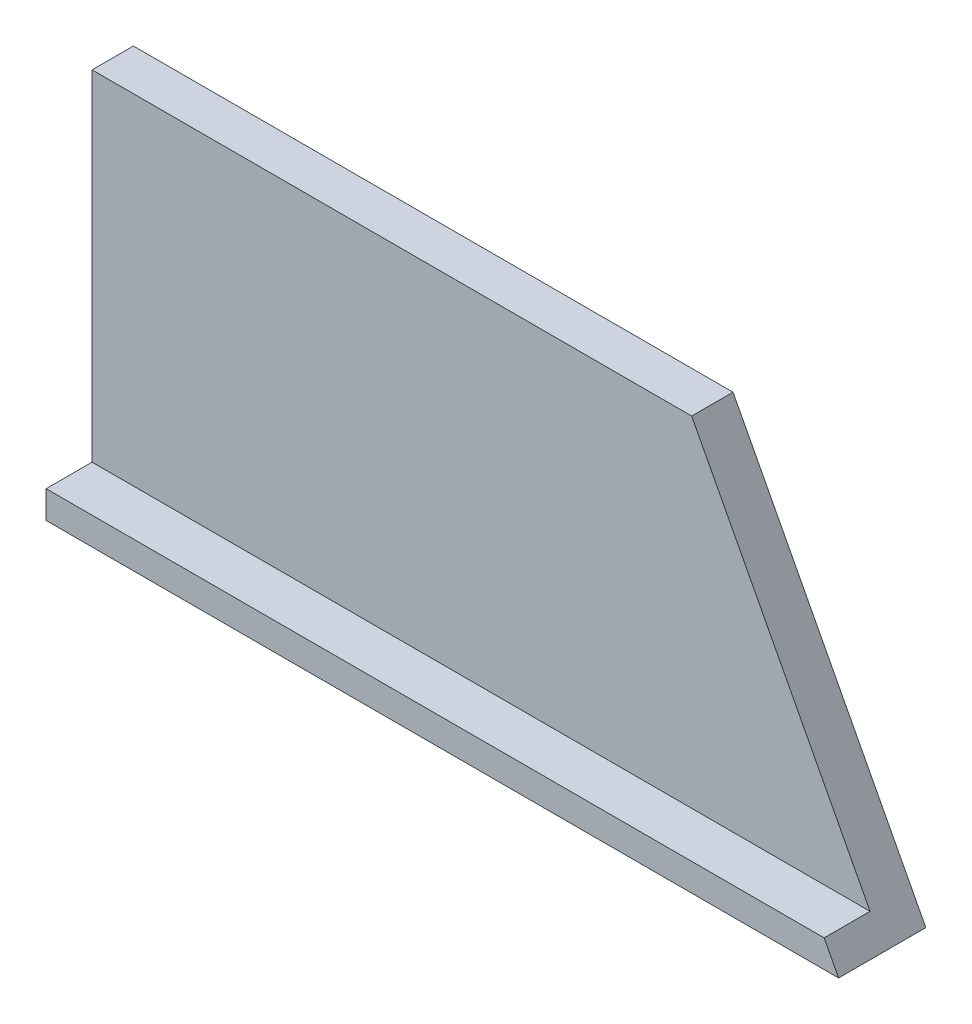
from build123d import *

# Parameters (mm, degrees)
SKETCH_1_W           = 135.4
SKETCH_1_H           = 96.8
EXTRUDE_1_DEPTH      = 4.5
SKETCH_2_W           = 135.4
SKETCH_2_H           = 4.5
EXTRUDE_2_DEPTH      = 40
CUT_EXTRUDE_1_DEPTH  = 40
SKETCH_4_W           = 96.8
SKETCH_4_H           = 4.5
EXTRUDE_3_DEPTH      = 21
SKETCH_5_W           = 96.8
SKETCH_5_H           = 4.5
EXTRUDE_4_DEPTH      = 21
SKETCH_6_W           = 2.5
SKETCH_6_H           = 87.8
CUT_EXTRUDE_2_DEPTH  = 189.231772026
SKETCH_7_W           = 21
SKETCH_7_H           = 4.5
EXTRUDE_6_DEPTH      = 40
SKETCH_9_W           = 4.8
SKETCH_9_H           = 40
CUT_EXTRUDE_4_DEPTH  = 187.977271346
CUT_EXTRUDE_5_DEPTH  = 190.23913443
SKETCH_11_W          = 80
SKETCH_11_H          = 50
CUT_EXTRUDE_6_DEPTH  = 0.3
SKETCH_12_W          = 2.153500311
SKETCH_12_H          = 0.443228659
SKETCH_12_H_2        = 0.381767619
SKETCH_12_W_2        = 2.028214344
SKETCH_12_H_3        = 1.758731319
EXTRUDE_9_DEPTH      = 0.1
SKETCH_13_W          = 177.4
SKETCH_13_H          = 4.5
CUT_EXTRUDE_7_DEPTH  = 100
CUT_EXTRUDE_8_DEPTH  = 119
EXTRUDE_10_DEPTH     = 5
SKETCH_16_W          = 4.8
SKETCH_16_H          = 3
CUT_EXTRUDE_9_DEPTH  = 5
CUT_EXTRUDE_10_DEPTH = 38


with BuildPart() as part:
    # 草图1 → 凸台-拉伸1 (new body)
    with BuildSketch(Plane(origin=(0, 0, 0), x_dir=(1, 0, 0), z_dir=(0, 1, 0))):
        with Locations((67.7, -48.4)):
            Rectangle(SKETCH_1_W, SKETCH_1_H)
        with BuildLine():
            Line((9.5, -21.9), (35.5, -21.9))
            ThreePointArc((35.5, -21.9), (38.681980515, -23.218019485), (40, -26.4))
            Line((40, -26.4), (40, -70.4))
            ThreePointArc((40, -70.4), (38.681980515, -73.581980515), (35.5, -74.9))
            Line((35.5, -74.9), (9.5, -74.9))
            ThreePointArc((9.5, -74.9), (6.318019485, -73.581980515), (5, -70.4))
            Line((5, -70.4), (5, -26.4))
            ThreePointArc((5, -26.4), (6.318019485, -23.218019485), (9.5, -21.9))
        make_face(mode=Mode.SUBTRACT)
    extrude(amount=EXTRUDE_1_DEPTH)

    # 草图2 → 凸台-拉伸2 (add)
    with BuildSketch(Plane(origin=(0, 4.5, 0), x_dir=(1, 0, 0), z_dir=(0, 1, 0))):
        with Locations((67.7, -2.25)):
            Rectangle(SKETCH_2_W, SKETCH_2_H)
        with Locations((67.7, -94.55)):
            Rectangle(SKETCH_2_W, SKETCH_2_H)
    extrude(amount=EXTRUDE_2_DEPTH)

    # 草图3 → 切除-拉伸1 (cut)
    with BuildSketch(Plane.XY.offset(96.8)):
        with BuildLine():
            Line((47.7, 44.5), (87.7, 44.5))
            ThreePointArc((87.7, 44.5), (67.7, 24.5), (47.7, 44.5))
        make_face()
    extrude(amount=-CUT_EXTRUDE_1_DEPTH, mode=Mode.SUBTRACT)

    # 草图4 → 凸台-拉伸3 (add)
    with BuildSketch(Plane.ZY):
        with Locations((48.4, 2.25)):
            Rectangle(SKETCH_4_W, SKETCH_4_H)
    extrude(amount=EXTRUDE_3_DEPTH)

    # 草图5 → 凸台-拉伸4 (add)
    with BuildSketch(Plane(origin=(135.4, 0, 0), x_dir=(0, 0, -1), z_dir=(1, 0, 0))):
        with Locations((-48.4, 2.25)):
            Rectangle(SKETCH_5_W, SKETCH_5_H)
    extrude(amount=EXTRUDE_4_DEPTH)

    # 草图6 → 切除-拉伸2 (cut, through all)
    with BuildSketch(Plane(origin=(0, 4.5, 0), x_dir=(1, 0, 0), z_dir=(0, 1, 0))):
        with Locations((-15.25, -48.4)):
            Rectangle(SKETCH_6_W, SKETCH_6_H)
        with Locations((150.65, -48.4)):
            Rectangle(SKETCH_6_W, SKETCH_6_H)
    extrude(amount=-CUT_EXTRUDE_2_DEPTH, mode=Mode.SUBTRACT)

    # 草图7 → 凸台-拉伸6 (add)
    with BuildSketch(Plane(origin=(0, 4.5, 0), x_dir=(1, 0, 0), z_dir=(0, 1, 0))):
        with Locations((145.9, -2.25)):
            Rectangle(SKETCH_7_W, SKETCH_7_H)
        with Locations((145.9, -94.55)):
            Rectangle(SKETCH_7_W, SKETCH_7_H)
        with Locations((-10.5, -2.25)):
            Rectangle(SKETCH_7_W, SKETCH_7_H)
        with Locations((-10.5, -94.55)):
            Rectangle(SKETCH_7_W, SKETCH_7_H)
    extrude(amount=EXTRUDE_6_DEPTH)

    # 草图9 → 切除-拉伸4 (cut, through all)
    with BuildSketch(Plane.XY.offset(4.5)):
        with Locations((67.7, 24.5)):
            Rectangle(SKETCH_9_W, SKETCH_9_H)
    extrude(amount=-CUT_EXTRUDE_4_DEPTH, mode=Mode.SUBTRACT)

    # 草图10 → 切除-拉伸5 (cut, through all)
    with BuildSketch(Plane.XY.offset(96.8)):
        Polygon((-21, 44.5), (0, 44.5), (-21, 4.5), align=None)
        Polygon((156.4, 44.5), (156.4, 4.5), (135.4, 44.5), align=None)
    extrude(amount=-CUT_EXTRUDE_5_DEPTH, mode=Mode.SUBTRACT)

    # 草图11 → 切除-拉伸6 (cut)
    with BuildSketch(Plane(origin=(0, 4.5, 0), x_dir=(1, 0, 0), z_dir=(0, 1, 0))):
        with Locations((85, -48.4)):
            Rectangle(SKETCH_11_W, SKETCH_11_H)
    extrude(amount=-CUT_EXTRUDE_6_DEPTH, mode=Mode.SUBTRACT)

    # 草图12 → 凸台-拉伸9 (add)
    # profile 1 of 21: a face of its own
    with BuildSketch(Plane(origin=(0, 4.2, 0), x_dir=(1, 0, 0), z_dir=(0, 1, 0))):
        with BuildLine():
            add(Edge.make_bspline(
                [(55.920909817, -50.5126391), (55.920330094, -50.418868998), (55.919099918, -50.219888299), (55.912694211, -49.904697314), (55.90362345, -49.555593656), (55.89402315, -49.311775096), (55.888997354, -49.184135066)],
                knots=[0, 0, 0, 0, 0.846714356, 1.796732788, 2.846580448, 4, 4, 4, 4], degree=3))
            Line((55.888997354, -49.184135066), (59.749223488, -49.184135066))
            add(Edge.make_bspline(
                [(59.749223488, -49.184135066), (59.74055538, -49.373608041), (59.723170988, -49.75360709), (59.720055186, -50.133991074), (59.718492968, -50.324710148)],
                knots=[0, 0, 0, 0, 0.99722868, 2, 2, 2, 2], degree=3))
            Line((59.718492968, -50.324710148), (59.718492968, -52.579857565))
            add(Edge.make_bspline(
                [(59.718492968, -52.579857565), (59.71798715, -52.605122659), (59.717024459, -52.653208083), (59.704986083, -52.722074896), (59.684640987, -52.783951707), (59.65799795, -52.839788518), (59.622634473, -52.888914206), (59.578530881, -52.930003935), (59.52709026, -52.964775361), (59.467204321, -52.992030744), (59.397753988, -53.0151107), (59.318440926, -53.040265713), (59.226546722, -53.06306035), (59.123911109, -53.088329714), (59.009539611, -53.112783948), (58.883350064, -53.137434655), (58.746057432, -53.163880054), (58.650062109, -53.179362552), (58.600374804, -53.187376314)],
                knots=[0, 0, 0, 0, 0.861425415, 1.63949542, 2.375049245, 3.07857147, 3.742842006, 4.427614151, 5.124942369, 5.852713644, 6.664885679, 7.621751021, 8.691368886, 9.89467842, 11.229057471, 12.681927417, 14.282561253, 16, 16, 16, 16], degree=3))
            add(Edge.make_bspline(
                [(58.600374804, -53.187376314), (58.586214482, -53.131585528), (58.556874712, -53.015988665), (58.4952126, -52.841603581), (58.420519449, -52.658635864), (58.362238898, -52.535851938), (58.332073722, -52.472300744)],
                knots=[0, 0, 0, 0, 0.902150766, 1.869229773, 2.897143974, 4, 4, 4, 4], degree=3))
            add(Edge.make_bspline(
                [(58.332073722, -52.472300744), (58.376216536, -52.47238952), (58.45863941, -52.472555281), (58.573250507, -52.465750067), (58.670595079, -52.459059081), (58.749703971, -52.445709284), (58.812325783, -52.431533402), (58.857220167, -52.413315464), (58.889603756, -52.39049656), (58.893976113, -52.369196405), (58.895860576, -52.36001615)],
                knots=[0, 0, 0, 0, 1.768003875, 3.301193302, 4.600280842, 5.672042812, 6.518131118, 7.154449636, 7.635572213, 8, 8, 8, 8], degree=3))
            Line((58.895860576, -52.36001615), (58.895860576, -51.80923067))
            Line((58.895860576, -51.80923067), (56.742360265, -51.80923067))
            Line((56.742360265, -51.80923067), (56.742360265, -53.12473333))
            Line((56.742360265, -53.12473333), (55.888997354, -53.12473333))
            add(Edge.make_bspline(
                [(55.888997354, -53.12473333), (55.894059779, -53.010096982), (55.903991116, -52.785206311), (55.912915781, -52.454211625), (55.919236293, -52.136652824), (55.920360552, -51.929397779), (55.920909817, -51.82814176)],
                knots=[0, 0, 0, 0, 1.061575059, 2.08257095, 3.063225531, 4, 4, 4, 4], degree=3))
            Line((55.920909817, -51.82814176), (55.920909817, -50.5126391))
        make_face()
        with Locations((57.819110421, -50.997826739)):
            Rectangle(SKETCH_12_W, SKETCH_12_H, mode=Mode.SUBTRACT)
        with Locations((57.819110421, -49.995538998)):
            Rectangle(SKETCH_12_W, SKETCH_12_H_2, mode=Mode.SUBTRACT)
    # profile 2 of 21: a face of its own
    with BuildSketch(Plane(origin=(0, 4.2, 0), x_dir=(1, 0, 0), z_dir=(0, 1, 0))):
        with BuildLine():
            add(Edge.make_bspline(
                [(55.262567515, -48.307133292), (55.314172299, -48.309672786), (55.428377233, -48.31529286), (55.61557138, -48.320271223), (55.834588916, -48.327122912), (56.084809804, -48.329450558), (56.366885362, -48.333758993), (56.680506665, -48.335329562), (57.026021094, -48.338592945), (57.266748051, -48.338113911), (57.392428965, -48.337863813)],
                knots=[0, 0, 0, 0, 0.582076541, 1.28817539, 2.109630885, 3.050725073, 4.107214628, 5.28793665, 6.584061357, 8, 8, 8, 8], degree=3))
            Line((57.392428965, -48.337863813), (57.392428965, -47.894635154))
            add(Edge.make_bspline(
                [(57.392428965, -47.894635154), (57.302994303, -47.894413367), (57.129243107, -47.893982486), (56.877100779, -47.897001733), (56.641108819, -47.899430832), (56.421636103, -47.901036551), (56.218339985, -47.905996136), (56.031222986, -47.912280913), (55.860585384, -47.917546497), (55.752279995, -47.922855393), (55.701068402, -47.925365674)],
                knots=[0, 0, 0, 0, 1.268705444, 2.464805981, 3.577075293, 4.61669139, 5.578261161, 6.46176692, 7.272655149, 8, 8, 8, 8], degree=3))
            Line((55.701068402, -47.925365674), (55.701068402, -47.304845551))
            add(Edge.make_bspline(
                [(55.701068402, -47.304845551), (55.750703873, -47.307359518), (55.855462565, -47.312665397), (56.021766797, -47.317900514), (56.206108409, -47.324726398), (56.408663176, -47.327116643), (56.629274544, -47.33142062), (56.867648064, -47.333020836), (57.124120637, -47.336286945), (57.301024134, -47.335818245), (57.392428965, -47.335576072)],
                knots=[0, 0, 0, 0, 0.705012697, 1.487972356, 2.360304969, 3.321760164, 4.361450436, 5.490484925, 6.703350675, 8, 8, 8, 8], degree=3))
            Line((57.392428965, -47.335576072), (57.392428965, -47.01763338))
            add(Edge.make_bspline(
                [(57.392428965, -47.01763338), (57.290387, -47.017406939), (57.09339152, -47.016969786), (56.807760282, -47.020007069), (56.542613252, -47.0224117), (56.297534272, -47.024024573), (56.072962679, -47.028970568), (55.868507335, -47.035223575), (55.684084168, -47.04052535), (55.56789724, -47.045853021), (55.513139451, -47.048363901)],
                knots=[0, 0, 0, 0, 1.302857261, 2.515210203, 3.647080722, 4.688409065, 5.64438486, 6.514996534, 7.300132061, 8, 8, 8, 8], degree=3))
            Line((55.513139451, -47.048363901), (55.513139451, -46.395931315))
            add(Edge.make_bspline(
                [(55.513139451, -46.395931315), (55.56790165, -46.398310987), (55.684505123, -46.40337795), (55.869245732, -46.411064564), (56.074171311, -46.414791343), (56.298720338, -46.420070317), (56.543786295, -46.423485186), (56.808943457, -46.425345015), (57.09417915, -46.428539206), (57.290780869, -46.428080791), (57.392428965, -46.427843778)],
                knots=[0, 0, 0, 0, 0.699858885, 1.490188073, 2.360657684, 3.316621111, 4.35799673, 5.489852607, 6.702189865, 8, 8, 8, 8], degree=3))
            add(Edge.make_bspline(
                [(57.392428965, -46.427843778), (57.391709631, -46.381354277), (57.390185364, -46.28284317), (57.386304328, -46.126704689), (57.374235558, -45.953857036), (57.366012007, -45.832931491), (57.361698445, -45.769501476)],
                knots=[0, 0, 0, 0, 0.84640916, 1.793538337, 2.842627543, 4, 4, 4, 4], degree=3))
            Line((57.361698445, -45.769501476), (58.245791876, -45.769501476))
            add(Edge.make_bspline(
                [(58.245791876, -45.769501476), (58.241275133, -45.834103034), (58.232685505, -45.956957778), (58.223310923, -46.131511294), (58.216929489, -46.286359526), (58.215654455, -46.382925042), (58.215061356, -46.427843778)],
                knots=[0, 0, 0, 0, 1.178907891, 2.241964945, 3.182226582, 4, 4, 4, 4], degree=3))
            add(Edge.make_bspline(
                [(58.215061356, -46.427843778), (58.322619119, -46.428081771), (58.53025204, -46.428541199), (58.830853404, -46.425354157), (59.109799348, -46.423477164), (59.367472347, -46.420071946), (59.603447899, -46.414802202), (59.817827398, -46.411089735), (60.010054798, -46.403386721), (60.130992272, -46.398311918), (60.187724375, -46.395931315)],
                knots=[0, 0, 0, 0, 1.30828854, 2.525561765, 3.656577085, 4.701389929, 5.660034743, 6.527646624, 7.309314964, 8, 8, 8, 8], degree=3))
            Line((60.187724375, -46.395931315), (60.187724375, -47.048363901))
            add(Edge.make_bspline(
                [(60.187724375, -47.048363901), (60.129814365, -47.045855335), (60.007321026, -47.040549126), (59.813051522, -47.035216647), (59.597957386, -47.028970598), (59.361566528, -47.024021853), (59.104275147, -47.022423097), (58.826126805, -47.019997751), (58.527493848, -47.016976411), (58.321437058, -47.017409698), (58.215061356, -47.01763338)],
                knots=[0, 0, 0, 0, 0.705059618, 1.49136752, 2.363901325, 3.322559729, 4.367332429, 5.49357162, 6.706069916, 8, 8, 8, 8], degree=3))
            Line((58.215061356, -47.01763338), (58.215061356, -47.335576072))
            add(Edge.make_bspline(
                [(58.215061356, -47.335576072), (58.314345719, -47.335818777), (58.506220042, -47.336287824), (58.783180409, -47.33303934), (59.038888123, -47.331421717), (59.272502392, -47.327161962), (59.484904368, -47.324725328), (59.675552037, -47.317939921), (59.845011694, -47.312775034), (59.950554289, -47.307368147), (59.999795423, -47.304845551)],
                knots=[0, 0, 0, 0, 1.33476867, 2.579538499, 3.723674973, 4.772542158, 5.720784798, 6.57925897, 7.33715008, 8, 8, 8, 8], degree=3))
            Line((59.999795423, -47.304845551), (59.999795423, -47.925365674))
            add(Edge.make_bspline(
                [(59.999795423, -47.925365674), (59.945431559, -47.92285784), (59.830819457, -47.917570722), (59.650336054, -47.912270881), (59.452579923, -47.905993874), (59.237858317, -47.901045756), (59.006173728, -47.899426346), (58.757574115, -47.897008608), (58.492036247, -47.893980486), (58.309223748, -47.894412588), (58.215061356, -47.894635154)],
                knots=[0, 0, 0, 0, 0.731642381, 1.542478119, 2.42743214, 3.391673867, 4.429891378, 5.54225982, 6.734076184, 8, 8, 8, 8], degree=3))
            Line((58.215061356, -47.894635154), (58.215061356, -48.337863813))
            add(Edge.make_bspline(
                [(58.215061356, -48.337863813), (58.346651928, -48.338112201), (58.599198078, -48.338588902), (58.962048074, -48.335330287), (59.292609713, -48.333747363), (59.590839537, -48.32944997), (59.856422653, -48.327109403), (60.089626435, -48.320275347), (60.290602473, -48.315210414), (60.41387548, -48.309666671), (60.470208773, -48.307133292)],
                knots=[0, 0, 0, 0, 1.400188647, 2.687215702, 3.861056488, 4.917561104, 5.860885799, 6.687011529, 7.399990579, 8, 8, 8, 8], degree=3))
            Line((60.470208773, -48.307133292), (60.470208773, -48.959565878))
            add(Edge.make_bspline(
                [(60.470208773, -48.959565878), (60.444995479, -48.958350785), (60.390637369, -48.955731128), (60.303561989, -48.95227654), (60.204671798, -48.948765385), (60.09437273, -48.944916421), (59.972609732, -48.943030625), (59.839447923, -48.940510184), (59.694855256, -48.938203966), (59.538444238, -48.935912663), (59.370615869, -48.933163697), (59.190951515, -48.932448189), (58.999872062, -48.931142138), (58.797365469, -48.929972381), (58.583433614, -48.9288815), (58.35768443, -48.927299434), (58.120505664, -48.92774851), (57.958579623, -48.927685573), (57.875843689, -48.927653415)],
                knots=[0, 0, 0, 0, 0.466956731, 1.006726273, 1.612041576, 2.297480839, 3.048306558, 3.864714675, 4.761281314, 5.723433641, 6.758460155, 7.86628996, 9.047000248, 10.293303119, 11.612486774, 13.004551338, 14.469478786, 16, 16, 16, 16], degree=3))
            add(Edge.make_bspline(
                [(57.875843689, -48.927653415), (57.794289699, -48.927685364), (57.635121524, -48.927747718), (57.401488578, -48.927303356), (57.178891248, -48.928880864), (56.966929319, -48.929976032), (56.765998634, -48.931141688), (56.57570714, -48.932450242), (56.396042905, -48.933171176), (56.227426464, -48.935912361), (56.069439659, -48.938213453), (55.922483305, -48.940525571), (55.786169174, -48.943027772), (55.660467838, -48.944939572), (55.545834172, -48.94877266), (55.441823099, -48.95230655), (55.348839574, -48.955780412), (55.290145019, -48.958355826), (55.262567515, -48.959565878)],
                knots=[0, 0, 0, 0, 1.497751429, 2.923147716, 4.290679031, 5.585856274, 6.81591496, 7.980855208, 9.080677159, 10.115456873, 11.077889054, 11.982444083, 12.814654035, 13.581755042, 14.291167594, 14.921031464, 15.493049083, 16, 16, 16, 16], degree=3))
            Line((55.262567515, -48.959565878), (55.262567515, -48.307133292))
        make_face()
    # profile 3 of 21: a face of its own
    with BuildSketch(Plane(origin=(0, 4.2, 0), x_dir=(1, 0, 0), z_dir=(0, 1, 0))):
        with BuildLine():
            add(Edge.make_bspline(
                [(55.802715508, -51.299813198), (55.656129696, -51.41782192), (55.360501647, -51.655816904), (54.931943047, -52.030622643), (54.511556265, -52.408376913), (54.233123225, -52.657895343), (54.095989685, -52.780787891)],
                knots=[0, 0, 0, 0, 0.999076555, 2.01489522, 3.022298338, 4, 4, 4, 4], degree=3))
            add(Edge.make_bspline(
                [(54.095989685, -52.780787891), (54.048629577, -52.720969299), (53.956697623, -52.604853852), (53.824256624, -52.434766798), (53.694858776, -52.279754104), (53.611399335, -52.179959973), (53.571206953, -52.131901134)],
                knots=[0, 0, 0, 0, 1.097024221, 2.129462651, 3.099186963, 4, 4, 4, 4], degree=3))
            add(Edge.make_bspline(
                [(53.571206953, -52.131901134), (53.595990719, -52.111031385), (53.644224516, -52.070414992), (53.708888806, -52.004223946), (53.761878107, -51.933528904), (53.80754941, -51.861847734), (53.842360958, -51.786752752), (53.865553407, -51.708606584), (53.882142155, -51.628301706), (53.883658764, -51.573321568), (53.884421872, -51.545657361)],
                knots=[0, 0, 0, 0, 1.128626418, 2.196515935, 3.215095519, 4.201629449, 5.153656748, 6.08719632, 7.037539753, 8, 8, 8, 8], degree=3))
            Line((53.884421872, -51.545657361), (53.884421872, -48.959565878))
            add(Edge.make_bspline(
                [(53.884421872, -48.959565878), (53.815869383, -48.960286548), (53.670479744, -48.96181498), (53.440311358, -48.965672136), (53.185480627, -48.977756024), (53.007419441, -48.985982531), (52.914046594, -48.990296399)],
                knots=[0, 0, 0, 0, 0.847290827, 1.79697791, 2.844765385, 4, 4, 4, 4], degree=3))
            Line((52.914046594, -48.990296399), (52.914046594, -48.275220829))
            add(Edge.make_bspline(
                [(52.914046594, -48.275220829), (52.989676068, -48.280214454), (53.131034611, -48.289548006), (53.328864083, -48.298700728), (53.49749236, -48.305168602), (53.600357251, -48.306521702), (53.64685131, -48.307133292)],
                knots=[0, 0, 0, 0, 1.239785955, 2.317275629, 3.239422833, 4, 4, 4, 4], degree=3))
            Line((53.64685131, -48.307133292), (54.707054263, -48.307133292))
            add(Edge.make_bspline(
                [(54.707054263, -48.307133292), (54.701937138, -48.39970182), (54.691424035, -48.58988332), (54.68282661, -48.883091826), (54.676629578, -49.191594115), (54.675645669, -49.402397013), (54.675141799, -49.510351359)],
                knots=[0, 0, 0, 0, 0.924137097, 1.898634279, 2.923868866, 4, 4, 4, 4], degree=3))
            Line((54.675141799, -49.510351359), (54.675141799, -51.470013003))
            add(Edge.make_bspline(
                [(54.675141799, -51.470013003), (54.726479417, -51.40094265), (54.829703305, -51.26206378), (54.997690344, -51.061971279), (55.180355931, -50.870057198), (55.310400604, -50.748776801), (55.376034052, -50.687566677)],
                knots=[0, 0, 0, 0, 0.981128507, 1.97274246, 2.976844663, 4, 4, 4, 4], degree=3))
            add(Edge.make_bspline(
                [(55.376034052, -50.687566677), (55.409108004, -50.747543323), (55.473116659, -50.863617276), (55.579592259, -51.024758392), (55.686785869, -51.170821734), (55.764987695, -51.257834582), (55.802715508, -51.299813198)],
                knots=[0, 0, 0, 0, 1.097944477, 2.124873025, 3.095360786, 4, 4, 4, 4], degree=3))
        make_face()
    # profile 4 of 21: a face of its own
    with BuildSketch(Plane(origin=(0, 4.2, 0), x_dir=(1, 0, 0), z_dir=(0, 1, 0))):
        with BuildLine():
            add(Edge.make_bspline(
                [(54.620772417, -47.706706202), (54.532105892, -47.589160189), (54.355869536, -47.35552206), (54.07242207, -47.023372666), (53.783399495, -46.702555605), (53.579320923, -46.501717189), (53.477833448, -46.40184103)],
                knots=[0, 0, 0, 0, 1.017212512, 2.021843369, 3.016270448, 4, 4, 4, 4], degree=3))
            add(Edge.make_bspline(
                [(53.477833448, -46.40184103), (53.560026822, -46.333108161), (53.725771557, -46.194506831), (53.893329821, -46.0581034), (53.977795376, -45.989342891)],
                knots=[0, 0, 0, 0, 0.991806762, 2, 2, 2, 2], degree=3))
            add(Edge.make_bspline(
                [(53.977795376, -45.989342891), (54.045796271, -46.045002617), (54.178645334, -46.153741514), (54.369043152, -46.317606669), (54.544878708, -46.479204921), (54.710260486, -46.634572722), (54.860775219, -46.788358614), (55.000128864, -46.937232972), (55.125241299, -47.083400975), (55.2018469, -47.181645089), (55.238928654, -47.229201193)],
                knots=[0, 0, 0, 0, 1.189769114, 2.324376942, 3.400485477, 4.423010638, 5.396189427, 6.313388948, 7.18357804, 8, 8, 8, 8], degree=3))
            add(Edge.make_bspline(
                [(55.238928654, -47.229201193), (55.184485961, -47.277247283), (55.079429436, -47.369960463), (54.922275624, -47.498026967), (54.771000651, -47.610019847), (54.66957463, -47.675297272), (54.620772417, -47.706706202)],
                knots=[0, 0, 0, 0, 1.114029263, 2.14971076, 3.109713586, 4, 4, 4, 4], degree=3))
        make_face()
    # profile 5 of 21: a face of its own
    with BuildSketch(Plane(origin=(0, 4.2, 0), x_dir=(1, 0, 0), z_dir=(0, 1, 0))):
        with BuildLine():
            add(Edge.make_bspline(
                [(64.280320521, -46.991630632), (64.315193545, -46.878492986), (64.381927855, -46.661988604), (64.466829057, -46.39583679), (64.528988968, -46.188537457), (64.562977258, -46.02582967), (64.593423816, -45.854490429), (64.606789555, -45.736500498), (64.613628472, -45.676127972)],
                knots=[0, 0, 0, 0, 1.56667797, 2.998052898, 3.69776078, 4.428985813, 5.196150953, 6, 6, 6, 6], degree=3))
            add(Edge.make_bspline(
                [(64.613628472, -45.676127972), (64.70274705, -45.692667799), (64.877416236, -45.725085259), (65.133615809, -45.779702822), (65.378810683, -45.838245934), (65.538015445, -45.88176611), (65.615916213, -45.903061046)],
                knots=[0, 0, 0, 0, 1.057971463, 2.073585752, 3.057382785, 4, 4, 4, 4], degree=3))
            add(Edge.make_bspline(
                [(65.615916213, -45.903061046), (65.590980607, -45.958955735), (65.544546841, -46.063039868), (65.481563185, -46.208681654), (65.430569566, -46.332356458), (65.388874544, -46.441839085), (65.348093523, -46.551978409), (65.30136357, -46.678018816), (65.242956288, -46.827158342), (65.20032728, -46.934134046), (65.177415327, -46.991630632)],
                knots=[0, 0, 0, 0, 1.251365267, 2.330226157, 3.244203, 3.986203782, 4.725357024, 5.645524874, 6.734532437, 8, 8, 8, 8], degree=3))
            Line((65.177415327, -46.991630632), (67.562576484, -46.991630632))
            add(Edge.make_bspline(
                [(67.562576484, -46.991630632), (67.78678248, -46.990165615), (68.234134674, -46.987242505), (68.681119128, -46.968878446), (68.904081892, -46.959718169)],
                knots=[0, 0, 0, 0, 1.002369049, 2, 2, 2, 2], degree=3))
            Line((68.904081892, -46.959718169), (68.904081892, -47.706706202))
            add(Edge.make_bspline(
                [(68.904081892, -47.706706202), (68.678361048, -47.6975474), (68.231370143, -47.67941039), (67.784022927, -47.676322373), (67.562576484, -47.674793739)],
                knots=[0, 0, 0, 0, 1.00995721, 2, 2, 2, 2], degree=3))
            Line((67.562576484, -47.674793739), (64.956391969, -47.674793739))
            add(Edge.make_bspline(
                [(64.956391969, -47.674793739), (64.927380374, -47.740839362), (64.865838313, -47.880941407), (64.756876407, -48.097493821), (64.6326435, -48.335631883), (64.491960506, -48.592838675), (64.333427822, -48.865568172), (64.153018915, -49.147831801), (63.953660209, -49.43960358), (63.810136858, -49.634113839), (63.736626699, -49.733738603)],
                knots=[0, 0, 0, 0, 0.721755319, 1.531053691, 2.425116919, 3.409656989, 4.464507478, 5.581195155, 6.761130329, 8, 8, 8, 8], degree=3))
            Line((63.736626699, -49.733738603), (63.736626699, -51.921515264))
            add(Edge.make_bspline(
                [(63.736626699, -51.921515264), (63.738130629, -52.140992592), (63.741096073, -52.573757278), (63.758687375, -53.006173272), (63.767357219, -53.219288777)],
                knots=[0, 0, 0, 0, 1.01430332, 2, 2, 2, 2], degree=3))
            Line((63.767357219, -53.219288777), (62.883263787, -53.219288777))
            add(Edge.make_bspline(
                [(62.883263787, -53.219288777), (62.892525162, -52.999085786), (62.910711399, -52.566680882), (62.912913588, -52.133901131), (62.913994308, -51.921515264)],
                knots=[0, 0, 0, 0, 1.018503677, 2, 2, 2, 2], degree=3))
            Line((62.913994308, -51.921515264), (62.913994308, -50.368442043))
            add(Edge.make_bspline(
                [(62.913994308, -50.368442043), (62.859865041, -50.440161886), (62.749788155, -50.58601084), (62.553875496, -50.786948281), (62.333354375, -50.979659232), (62.169362068, -51.093712652), (62.085452201, -51.152070312)],
                knots=[0, 0, 0, 0, 0.939613832, 1.910791893, 2.931015873, 4, 4, 4, 4], degree=3))
            add(Edge.make_bspline(
                [(62.085452201, -51.152070312), (62.038739122, -51.102259745), (61.94548832, -51.002825598), (61.795032693, -50.863348425), (61.638563036, -50.729396643), (61.528418344, -50.646423123), (61.47320568, -50.604830661)],
                knots=[0, 0, 0, 0, 0.996075157, 1.988411124, 2.991642928, 4, 4, 4, 4], degree=3))
            add(Edge.make_bspline(
                [(61.47320568, -50.604830661), (61.606794163, -50.510211851), (61.872449886, -50.322051707), (62.191628029, -50.070875197), (62.434152897, -49.859003987), (62.604278471, -49.690208909), (62.765971446, -49.514775625), (62.86470039, -49.390420712), (62.913994308, -49.328332123)],
                knots=[0, 0, 0, 0, 1.524307902, 3.031257706, 3.77986444, 4.521842929, 5.261977788, 6, 6, 6, 6], degree=3))
            add(Edge.make_bspline(
                [(62.913994308, -49.328332123), (62.913273869, -49.28460059), (62.911748328, -49.191998335), (62.90790338, -49.045698933), (62.895846696, -48.884676451), (62.887584447, -48.772423347), (62.883263787, -48.713721715)],
                knots=[0, 0, 0, 0, 0.852696723, 1.805599641, 2.852460399, 4, 4, 4, 4], degree=3))
            Line((62.883263787, -48.713721715), (63.424593723, -48.713721715))
            add(Edge.make_bspline(
                [(63.424593723, -48.713721715), (63.456141181, -48.675839413), (63.521080093, -48.597860533), (63.61259283, -48.471532051), (63.701719715, -48.333811972), (63.784838791, -48.187489004), (63.86531395, -48.043087385), (63.941084908, -47.90841411), (64.009227465, -47.786835597), (64.052938138, -47.71061466), (64.07348048, -47.674793739)],
                knots=[0, 0, 0, 0, 0.963897617, 1.984136456, 3.048461549, 4.170461594, 5.274324955, 6.281651267, 7.192441921, 8, 8, 8, 8], degree=3))
            Line((64.07348048, -47.674793739), (63.397409032, -47.674793739))
            add(Edge.make_bspline(
                [(63.397409032, -47.674793739), (63.275271904, -47.675303499), (63.035317528, -47.676304991), (62.681509957, -47.682532435), (62.339859747, -47.691205455), (62.116168685, -47.701599346), (62.006262014, -47.706706202)],
                knots=[0, 0, 0, 0, 1.053174794, 2.069099745, 3.051286103, 4, 4, 4, 4], degree=3))
            Line((62.006262014, -47.706706202), (62.006262014, -46.959718169))
            add(Edge.make_bspline(
                [(62.006262014, -46.959718169), (62.116168693, -46.964824574), (62.33985977, -46.975217547), (62.681903681, -46.983907727), (63.035711757, -46.990101794), (63.275665948, -46.991116043), (63.397409032, -46.991630632)],
                knots=[0, 0, 0, 0, 0.948713993, 1.930900449, 2.950222297, 4, 4, 4, 4], degree=3))
            Line((63.397409032, -46.991630632), (64.280320521, -46.991630632))
        make_face()
    # profile 6 of 21: a face of its own
    with BuildSketch(Plane(origin=(0, 4.2, 0), x_dir=(1, 0, 0), z_dir=(0, 1, 0))):
        with BuildLine():
            Line((65.858214547, -49.434707001), (65.858214547, -49.071850472))
            add(Edge.make_bspline(
                [(65.858214547, -49.071850472), (65.857522126, -48.971780183), (65.856186281, -48.77872073), (65.852704085, -48.498901961), (65.841367857, -48.239676848), (65.831979493, -48.073492876), (65.827484026, -47.993918373)],
                knots=[0, 0, 0, 0, 1.113428587, 2.148069297, 3.113232981, 4, 4, 4, 4], degree=3))
            Line((65.827484026, -47.993918373), (66.743489922, -47.993918373))
            add(Edge.make_bspline(
                [(66.743489922, -47.993918373), (66.738348267, -48.071117305), (66.727520846, -48.233684697), (66.719123239, -48.490680366), (66.712996661, -48.772788703), (66.712063586, -48.969411174), (66.711577458, -49.071850472)],
                knots=[0, 0, 0, 0, 0.86071668, 1.81251815, 2.860333183, 4, 4, 4, 4], degree=3))
            Line((66.711577458, -49.071850472), (66.711577458, -49.434707001))
            Line((66.711577458, -49.434707001), (67.281274028, -49.434707001))
            add(Edge.make_bspline(
                [(67.281274028, -49.434707001), (67.475932972, -49.433156466), (67.870902478, -49.430010379), (68.265472861, -49.411952614), (68.465581005, -49.402794537)],
                knots=[0, 0, 0, 0, 0.985691003, 2, 2, 2, 2], degree=3))
            Line((68.465581005, -49.402794537), (68.465581005, -50.149782571))
            add(Edge.make_bspline(
                [(68.465581005, -50.149782571), (68.263502748, -50.14062657), (67.868926688, -50.12274865), (67.473961615, -50.119469751), (67.281274028, -50.117870107)],
                knots=[0, 0, 0, 0, 1.024280376, 2, 2, 2, 2], degree=3))
            Line((67.281274028, -50.117870107), (66.711577458, -50.117870107))
            Line((66.711577458, -50.117870107), (66.711577458, -52.065712321))
            Line((66.711577458, -52.065712321), (67.750505435, -52.065712321))
            add(Edge.make_bspline(
                [(67.750505435, -52.065712321), (67.953045083, -52.064228107), (68.358652565, -52.06125581), (68.763858218, -52.042959783), (68.966724875, -52.033799857)],
                knots=[0, 0, 0, 0, 0.998697792, 2, 2, 2, 2], degree=3))
            Line((68.966724875, -52.033799857), (68.966724875, -52.748875427))
            add(Edge.make_bspline(
                [(68.966724875, -52.748875427), (68.761889426, -52.739614992), (68.356685802, -52.721296083), (67.951074969, -52.71918755), (67.750505435, -52.718144907)],
                knots=[0, 0, 0, 0, 1.011024764, 2, 2, 2, 2], degree=3))
            Line((67.750505435, -52.718144907), (65.214055562, -52.718144907))
            add(Edge.make_bspline(
                [(65.214055562, -52.718144907), (65.085224563, -52.718839118), (64.837797756, -52.720172387), (64.481958161, -52.723581682), (64.157323888, -52.734856371), (63.951337969, -52.744365335), (63.853639065, -52.748875427)],
                knots=[0, 0, 0, 0, 1.136006145, 2.181760411, 3.137610875, 4, 4, 4, 4], degree=3))
            Line((63.853639065, -52.748875427), (63.853639065, -52.033799857))
            add(Edge.make_bspline(
                [(63.853639065, -52.033799857), (63.950147169, -52.038947495), (64.154503492, -52.04984764), (64.478061613, -52.058154257), (64.83502164, -52.064307775), (65.084038375, -52.06523053), (65.214055562, -52.065712321)],
                knots=[0, 0, 0, 0, 0.852115214, 1.80435762, 2.853606175, 4, 4, 4, 4], degree=3))
            Line((65.214055562, -52.065712321), (65.858214547, -52.065712321))
            Line((65.858214547, -52.065712321), (65.858214547, -50.117870107))
            Line((65.858214547, -50.117870107), (65.33934153, -50.117870107))
            add(Edge.make_bspline(
                [(65.33934153, -50.117870107), (65.149017843, -50.119480687), (64.757991608, -50.122789677), (64.367356023, -50.140627122), (64.166853984, -50.149782571)],
                knots=[0, 0, 0, 0, 0.973457377, 2, 2, 2, 2], degree=3))
            Line((64.166853984, -50.149782571), (64.166853984, -49.402794537))
            add(Edge.make_bspline(
                [(64.166853984, -49.402794537), (64.363021772, -49.411954111), (64.753644487, -49.430193281), (65.144680741, -49.433206832), (65.33934153, -49.434707001)],
                knots=[0, 0, 0, 0, 1.004384954, 2, 2, 2, 2], degree=3))
            Line((65.33934153, -49.434707001), (65.858214547, -49.434707001))
        make_face()
    # profile 7 of 21: a face of its own
    with BuildSketch(Plane(origin=(0, 4.2, 0), x_dir=(1, 0, 0), z_dir=(0, 1, 0))):
        with BuildLine():
            add(Edge.make_bspline(
                [(74.300361267, -52.003069337), (74.19750355, -52.024603036), (74.000326007, -52.06588299), (73.717815244, -52.127262696), (73.461437287, -52.185277213), (73.230636017, -52.238763238), (73.025410584, -52.286194856), (72.846466116, -52.332007828), (72.693111095, -52.370857806), (72.443657327, -52.444811137), (72.079599745, -52.55189241), (71.673952386, -52.663026392), (71.351374117, -52.755571667), (71.128146737, -52.831632462), (70.925971046, -52.910519825), (70.801086706, -52.97073253), (70.741530621, -52.999447363)],
                knots=[0, 0, 0, 0, 1.192240491, 2.2855169, 3.279885381, 4.174405027, 4.973450738, 5.669435478, 6.270054934, 6.767992066, 8.620994659, 10.575301776, 11.539889526, 12.427570837, 13.250124353, 14, 14, 14, 14], degree=3))
            add(Edge.make_bspline(
                [(70.741530621, -52.999447363), (70.676154808, -52.858272107), (70.54552327, -52.576180913), (70.433468186, -52.286209236), (70.377492149, -52.141356679)],
                knots=[0, 0, 0, 0, 1.000919272, 2, 2, 2, 2], degree=3))
            add(Edge.make_bspline(
                [(70.377492149, -52.141356679), (70.431088996, -52.133980577), (70.530502938, -52.120299037), (70.667892458, -52.099795934), (70.781566298, -52.077973317), (70.848761183, -52.060485865), (70.878636019, -52.052710947)],
                knots=[0, 0, 0, 0, 1.27470452, 2.364381645, 3.272804326, 4, 4, 4, 4], degree=3))
            Line((70.878636019, -52.052710947), (70.878636019, -48.695992569))
            add(Edge.make_bspline(
                [(70.878636019, -48.695992569), (70.877941006, -48.625850343), (70.876468113, -48.477202887), (70.863778574, -48.242691834), (70.843417654, -47.984625928), (70.825402794, -47.805169839), (70.815993035, -47.711433975)],
                knots=[0, 0, 0, 0, 0.85276773, 1.807210309, 2.854633245, 4, 4, 4, 4], degree=3))
            Line((70.815993035, -47.711433975), (71.70126841, -47.711433975))
            add(Edge.make_bspline(
                [(71.70126841, -47.711433975), (71.69620259, -47.800063867), (71.68623222, -47.974502128), (71.677301157, -48.232626206), (71.671018781, -48.482424438), (71.66990303, -48.646347274), (71.669355947, -48.726723089)],
                knots=[0, 0, 0, 0, 1.048565571, 2.063750158, 3.050604154, 4, 4, 4, 4], degree=3))
            Line((71.669355947, -48.726723089), (71.669355947, -51.940426353))
            add(Edge.make_bspline(
                [(71.669355947, -51.940426353), (71.716932173, -51.924365388), (71.817537211, -51.890402752), (71.979249752, -51.84292171), (72.158453642, -51.790065712), (72.285050326, -51.756874924), (72.35133711, -51.739496028)],
                knots=[0, 0, 0, 0, 0.847273092, 1.791649932, 2.843694632, 4, 4, 4, 4], degree=3))
            Line((72.35133711, -51.739496028), (72.35133711, -47.09800551))
            add(Edge.make_bspline(
                [(72.35133711, -47.09800551), (72.35076591, -47.021963788), (72.349567136, -46.862375627), (72.343195819, -46.612187983), (72.334114135, -46.339504689), (72.324456159, -46.150468163), (72.319424647, -46.051985875)],
                knots=[0, 0, 0, 0, 0.871874341, 1.829795762, 2.86938951, 4, 4, 4, 4], degree=3))
            Line((72.319424647, -46.051985875), (73.204700022, -46.051985875))
            add(Edge.make_bspline(
                [(73.204700022, -46.051985875), (73.199638099, -46.144556415), (73.189711404, -46.326092084), (73.180783903, -46.593273717), (73.174464554, -46.849373873), (73.173337657, -47.016447859), (73.172787558, -47.09800551)],
                knots=[0, 0, 0, 0, 1.062912254, 2.08442652, 3.064907251, 4, 4, 4, 4], degree=3))
            Line((73.172787558, -47.09800551), (73.172787558, -48.369776276))
            add(Edge.make_bspline(
                [(73.172787558, -48.369776276), (73.283508965, -48.369256653), (73.495566, -48.368261455), (73.799468969, -48.356382241), (74.075494945, -48.337198277), (74.249598153, -48.316813375), (74.33227373, -48.307133292)],
                knots=[0, 0, 0, 0, 1.143404036, 2.189882497, 3.140437956, 4, 4, 4, 4], degree=3))
            Line((74.33227373, -48.307133292), (74.33227373, -49.115582366))
            add(Edge.make_bspline(
                [(74.33227373, -49.115582366), (74.142411657, -49.106327815), (73.756145928, -49.087499852), (73.369423454, -49.085744424), (73.172787558, -49.084851846)],
                knots=[0, 0, 0, 0, 0.98306455, 2, 2, 2, 2], degree=3))
            Line((73.172787558, -49.084851846), (73.172787558, -51.56456845))
            add(Edge.make_bspline(
                [(73.172787558, -51.56456845), (73.207050557, -51.554281029), (73.279409704, -51.532555288), (73.393053689, -51.499438408), (73.518072948, -51.466331179), (73.653859533, -51.432676239), (73.800027257, -51.395189984), (73.957666943, -51.359597894), (74.125111588, -51.319663469), (74.240817266, -51.294852286), (74.300361267, -51.282084052)],
                knots=[0, 0, 0, 0, 0.738406826, 1.55942238, 2.44312661, 3.40758985, 4.44699898, 5.557553262, 6.743077653, 8, 8, 8, 8], degree=3))
            Line((74.300361267, -51.282084052), (74.300361267, -52.003069337))
        make_face()
    # profile 8 of 21: a face of its own
    with BuildSketch(Plane(origin=(0, 4.2, 0), x_dir=(1, 0, 0), z_dir=(0, 1, 0))):
        with BuildLine():
            add(Edge.make_bspline(
                [(75.365291992, -45.894787444), (75.360669154, -45.98223846), (75.351155938, -46.162201626), (75.342160123, -46.439614501), (75.336058245, -46.732364146), (75.33506945, -46.932530121), (75.334561471, -47.035362527)],
                knots=[0, 0, 0, 0, 0.920890772, 1.895077115, 2.918625991, 4, 4, 4, 4], degree=3))
            Line((75.334561471, -47.035362527), (75.334561471, -48.745634179))
            add(Edge.make_bspline(
                [(75.334561471, -48.745634179), (75.385602271, -48.702869665), (75.496401067, -48.610036937), (75.678933967, -48.465361307), (75.891666137, -48.306090402), (76.126179217, -48.133676234), (76.369089701, -47.953085783), (76.605619331, -47.769335381), (76.828012184, -47.584877128), (76.969506828, -47.459653268), (77.038923408, -47.398219055)],
                knots=[0, 0, 0, 0, 0.735258864, 1.5960917, 2.571458391, 3.669531233, 4.810211554, 5.913674577, 6.976458959, 8, 8, 8, 8], degree=3))
            add(Edge.make_bspline(
                [(77.038923408, -47.398219055), (77.097576416, -47.466089322), (77.210953254, -47.59728321), (77.3694877, -47.791866966), (77.516961961, -47.972064108), (77.608454381, -48.089867636), (77.652351872, -48.146389032)],
                knots=[0, 0, 0, 0, 1.112390344, 2.150261388, 3.112506991, 4, 4, 4, 4], degree=3))
            add(Edge.make_bspline(
                [(77.652351872, -48.146389032), (77.585000056, -48.185032033), (77.453051527, -48.260737298), (77.258770166, -48.371465834), (77.073245356, -48.480066118), (76.893554291, -48.581859158), (76.72261796, -48.681521437), (76.558858333, -48.776027163), (76.403247039, -48.867339797), (76.253920535, -48.953325136), (76.112728634, -49.036090929), (75.978722416, -49.113735255), (75.853644673, -49.188824067), (75.735033051, -49.258248122), (75.624533182, -49.324394984), (75.521094734, -49.385891848), (75.42571133, -49.444001421), (75.364132922, -49.480840774), (75.334561471, -49.498531928)],
                knots=[0, 0, 0, 0, 1.388973859, 2.721130126, 3.999988273, 5.234242539, 6.415196029, 7.539332927, 8.616288651, 9.642520876, 10.621571535, 11.543806958, 12.412806848, 13.231059768, 14.002158277, 14.716449237, 15.383607669, 16, 16, 16, 16], degree=3))
            Line((75.334561471, -49.498531928), (75.334561471, -51.799775125))
            add(Edge.make_bspline(
                [(75.334561471, -51.799775125), (75.333235795, -51.832501765), (75.330751269, -51.893836635), (75.341006193, -51.979223486), (75.362254677, -52.0521867), (75.400586497, -52.109500365), (75.450073346, -52.154221644), (75.513912119, -52.181193285), (75.588837935, -52.195844343), (75.642592411, -52.192689759), (75.671415252, -52.190998288)],
                knots=[0, 0, 0, 0, 1.275743143, 2.390943294, 3.343590969, 4.208923963, 5.04750116, 5.907357308, 6.877937014, 8, 8, 8, 8], degree=3))
            Line((75.671415252, -52.190998288), (76.341576985, -52.190998288))
            add(Edge.make_bspline(
                [(76.341576985, -52.190998288), (76.357881767, -52.189790885), (76.391791828, -52.187279774), (76.442047119, -52.167762671), (76.493099777, -52.138605832), (76.538704052, -52.105870197), (76.574226794, -52.062098822), (76.601877603, -52.008133704), (76.630413228, -51.935002262), (76.660803105, -51.842566338), (76.692869106, -51.730630076), (76.724870777, -51.598628806), (76.761255297, -51.447308791), (76.782832065, -51.33929729), (76.794261188, -51.282084052)],
                knots=[0, 0, 0, 0, 0.539351765, 1.121723089, 1.76476379, 2.490873648, 2.964041199, 3.618515214, 4.491461995, 5.56509521, 6.842195718, 8.349722661, 10.066463425, 12, 12, 12, 12], degree=3))
            add(Edge.make_bspline(
                [(76.794261188, -51.282084052), (76.869543884, -51.320655614), (77.019248273, -51.397357599), (77.24908033, -51.498564603), (77.480640236, -51.588773208), (77.637143189, -51.640489518), (77.714994856, -51.666215556)],
                knots=[0, 0, 0, 0, 1.015948831, 2.020278327, 3.015196649, 4, 4, 4, 4], degree=3))
            add(Edge.make_bspline(
                [(77.714994856, -51.666215556), (77.696238833, -51.732962305), (77.660291996, -51.860885718), (77.600001731, -52.041936764), (77.537830959, -52.203869491), (77.473683934, -52.346775195), (77.404526262, -52.468629286), (77.335868158, -52.57314523), (77.262245461, -52.656699126), (77.16197621, -52.742664632), (77.023564456, -52.821436901), (76.842825293, -52.887773613), (76.645353067, -52.930663827), (76.507277933, -52.934716283), (76.436132432, -52.936804379)],
                knots=[0, 0, 0, 0, 1.254000706, 2.40335376, 3.450214402, 4.390954533, 5.233373444, 5.982515911, 6.648921073, 7.240258341, 8.364728838, 9.505788649, 10.714816256, 12, 12, 12, 12], degree=3))
            Line((76.436132432, -52.936804379), (75.503579333, -52.936804379))
            add(Edge.make_bspline(
                [(75.503579333, -52.936804379), (75.459855787, -52.938479161), (75.375557551, -52.941708111), (75.253118567, -52.938419229), (75.139646778, -52.92695543), (75.034727434, -52.907049551), (74.939008114, -52.878680871), (74.851750083, -52.843617078), (74.773857145, -52.799416973), (74.70517957, -52.746896605), (74.643726526, -52.688100343), (74.593864586, -52.619073695), (74.552244004, -52.542799514), (74.519215713, -52.45866181), (74.495434163, -52.366594046), (74.482059764, -52.26666637), (74.475603516, -52.159116136), (74.479294907, -52.085015144), (74.48119856, -52.046801231)],
                knots=[0, 0, 0, 0, 1.310878138, 2.52735021, 3.666800865, 4.724883692, 5.722213113, 6.653942831, 7.536904831, 8.396351073, 9.239508062, 10.075360541, 10.936507776, 11.837515984, 12.776694891, 13.778416472, 14.854328458, 16, 16, 16, 16], degree=3))
            Line((74.48119856, -52.046801231), (74.48119856, -47.035362527))
            add(Edge.make_bspline(
                [(74.48119856, -47.035362527), (74.480656041, -46.94553146), (74.479551865, -46.762700071), (74.473194151, -46.482962687), (74.464298683, -46.192539898), (74.454350817, -45.995238692), (74.449286096, -45.894787444)],
                knots=[0, 0, 0, 0, 0.944650099, 1.922627616, 2.942354933, 4, 4, 4, 4], degree=3))
            Line((74.449286096, -45.894787444), (75.365291992, -45.894787444))
        make_face()
    # profile 9 of 21: a face of its own
    with BuildSketch(Plane(origin=(0, 4.2, 0), x_dir=(1, 0, 0), z_dir=(0, 1, 0))):
        with BuildLine():
            add(Edge.make_bspline(
                [(84.582793379, -45.706858493), (84.580265345, -45.745066049), (84.574795022, -45.827742001), (84.569687821, -45.961366257), (84.562860853, -46.113786594), (84.560494886, -46.284834253), (84.556197697, -46.474317797), (84.554600058, -46.682357556), (84.551345769, -46.908886352), (84.551817917, -47.066091626), (84.552062859, -47.14764712)],
                knots=[0, 0, 0, 0, 0.637556256, 1.379584956, 2.226487074, 3.177920631, 4.227738209, 5.382409152, 6.642037192, 8, 8, 8, 8], degree=3))
            add(Edge.make_bspline(
                [(84.552062859, -47.14764712), (84.645831486, -47.147884178), (84.828644396, -47.14834635), (85.096542814, -47.145062096), (85.351067784, -47.143448199), (85.592562417, -47.139163398), (85.820717583, -47.136701156), (86.035793614, -47.129832369), (86.237940255, -47.12460166), (86.368319978, -47.119421137), (86.431352373, -47.1169166)],
                knots=[0, 0, 0, 0, 1.197245059, 2.334169336, 3.420791261, 4.447112271, 5.418104748, 6.333990519, 7.194563647, 8, 8, 8, 8], degree=3))
            Line((86.431352373, -47.1169166), (86.431352373, -47.86272269))
            add(Edge.make_bspline(
                [(86.431352373, -47.86272269), (86.367137715, -47.860230237), (86.234786536, -47.855093105), (86.029886147, -47.849678846), (85.813215168, -47.843481035), (85.584314326, -47.838419001), (85.343569042, -47.836802606), (85.090241536, -47.834396942), (84.825097911, -47.831349839), (84.64425533, -47.831775282), (84.552062859, -47.83199217)],
                knots=[0, 0, 0, 0, 0.820516063, 1.691144541, 2.617086077, 3.588168333, 4.614426187, 5.690986077, 6.822878442, 8, 8, 8, 8], degree=3))
            Line((84.552062859, -47.83199217), (84.552062859, -49.372064017))
            Line((84.552062859, -49.372064017), (86.148867974, -49.372064017))
            add(Edge.make_bspline(
                [(86.148867974, -49.372064017), (86.146338982, -49.420516868), (86.140871478, -49.525268562), (86.13581177, -49.693550896), (86.128926504, -49.884589596), (86.126579414, -50.097781723), (86.122269031, -50.333759014), (86.120680802, -50.592224955), (86.117418367, -50.873519046), (86.117891705, -51.068545183), (86.118137454, -51.169799458)],
                knots=[0, 0, 0, 0, 0.647551862, 1.399962105, 2.246972141, 3.198872674, 4.245412525, 5.39704943, 6.64859204, 8, 8, 8, 8], degree=3))
            add(Edge.make_bspline(
                [(86.118137454, -51.169799458), (86.117894774, -51.271841651), (86.117425335, -51.469231544), (86.120697295, -51.755647578), (86.12229224, -52.0219922), (86.126591586, -52.268608304), (86.128997159, -52.495190479), (86.135840984, -52.7019927), (86.141012074, -52.888781337), (86.14635015, -53.006544628), (86.148867974, -53.062090346)],
                knots=[0, 0, 0, 0, 1.293916108, 2.502944647, 3.632043067, 4.671280682, 5.630594262, 6.505218673, 7.294952597, 8, 8, 8, 8], degree=3))
            Line((86.148867974, -53.062090346), (85.295505063, -53.062090346))
            Line((85.295505063, -53.062090346), (85.295505063, -52.435660508))
            Line((85.295505063, -52.435660508), (83.267290719, -52.435660508))
            Line((83.267290719, -52.435660508), (83.267290719, -53.187376314))
            Line((83.267290719, -53.187376314), (82.445840271, -53.187376314))
            add(Edge.make_bspline(
                [(82.445840271, -53.187376314), (82.448342238, -53.126314), (82.453571307, -52.998694781), (82.458922007, -52.798912402), (82.465169925, -52.58263652), (82.470146019, -52.350187132), (82.471778644, -52.101563144), (82.47418251, -51.836810042), (82.477221901, -51.555906752), (82.476791638, -51.363245017), (82.476570791, -51.264354905)],
                knots=[0, 0, 0, 0, 0.762557009, 1.59373144, 2.493702643, 3.462362301, 4.494777691, 5.596014728, 6.766073754, 8, 8, 8, 8], degree=3))
            add(Edge.make_bspline(
                [(82.476570791, -51.264354905), (82.476794657, -51.16349489), (82.477228403, -50.968075328), (82.474198219, -50.684413979), (82.471781526, -50.419661059), (82.47017684, -50.173794104), (82.465188972, -49.946466097), (82.458982898, -49.738069328), (82.453639061, -49.548527231), (82.448347364, -49.428792018), (82.445840271, -49.372064017)],
                knots=[0, 0, 0, 0, 1.278927142, 2.477962968, 3.597068821, 4.636245159, 5.595648652, 6.480259612, 7.279979278, 8, 8, 8, 8], degree=3))
            Line((82.445840271, -49.372064017), (83.761342931, -49.372064017))
            Line((83.761342931, -49.372064017), (83.761342931, -46.754060071))
            add(Edge.make_bspline(
                [(83.761342931, -46.754060071), (83.760855916, -46.654772515), (83.759920448, -46.464059023), (83.753792803, -46.190223717), (83.745383147, -45.940317418), (83.734570971, -45.782087005), (83.729430468, -45.706858493)],
                knots=[0, 0, 0, 0, 1.136976211, 2.183926308, 3.136572301, 4, 4, 4, 4], degree=3))
            Line((83.729430468, -45.706858493), (84.582793379, -45.706858493))
        make_face()
        with Locations((84.281397891, -50.903862262)):
            Rectangle(SKETCH_12_W_2, SKETCH_12_H_3, mode=Mode.SUBTRACT)
    # profile 10 of 21: a face of its own
    with BuildSketch(Plane(origin=(0, 4.2, 0), x_dir=(1, 0, 0), z_dir=(0, 1, 0))):
        with BuildLine():
            add(Edge.make_bspline(
                [(82.265002978, -46.208002363), (82.262481443, -46.27182231), (82.257096847, -46.408106183), (82.251947562, -46.625620786), (82.245097684, -46.869462972), (82.242710842, -47.139771001), (82.238427962, -47.436425405), (82.236813962, -47.759500949), (82.233558784, -48.108955505), (82.234028953, -48.350864277), (82.234272458, -48.476151154)],
                knots=[0, 0, 0, 0, 0.67571221, 1.442945073, 2.301848223, 3.256449108, 4.302743328, 5.440693871, 6.674510761, 8, 8, 8, 8], degree=3))
            add(Edge.make_bspline(
                [(82.234272458, -48.476151154), (82.23403254, -48.60340789), (82.233566814, -48.850438264), (82.236841594, -49.210530481), (82.238459154, -49.549364285), (82.242740284, -49.867294869), (82.245164247, -50.163600759), (82.252052162, -50.43856992), (82.257240678, -50.692322756), (82.262491849, -50.854618496), (82.265002978, -50.932228897)],
                knots=[0, 0, 0, 0, 1.243352852, 2.413592625, 3.518394274, 4.553944479, 5.520210287, 6.41347606, 7.241318603, 8, 8, 8, 8], degree=3))
            Line((82.265002978, -50.932228897), (81.411640067, -50.932228897))
            Line((81.411640067, -50.932228897), (81.411640067, -46.860434949))
            Line((81.411640067, -46.860434949), (80.072498545, -46.860434949))
            Line((80.072498545, -46.860434949), (80.072498545, -51.026784344))
            Line((80.072498545, -51.026784344), (79.219135633, -51.026784344))
            add(Edge.make_bspline(
                [(79.219135633, -51.026784344), (79.221481289, -50.941684268), (79.226324519, -50.765972493), (79.234177507, -50.494156744), (79.237924207, -50.205330888), (79.243202828, -49.899222405), (79.246650216, -49.575757785), (79.248526586, -49.234958134), (79.251726477, -48.877228709), (79.251277601, -48.632956371), (79.251048097, -48.508063618)],
                knots=[0, 0, 0, 0, 0.811102554, 1.674737269, 2.590752523, 3.563065499, 4.591629033, 5.672708178, 6.810090882, 8, 8, 8, 8], degree=3))
            add(Edge.make_bspline(
                [(79.251048097, -48.508063618), (79.251283629, -48.384352771), (79.251739697, -48.14480807), (79.248561674, -47.79771605), (79.246667925, -47.474251437), (79.243282066, -47.174817576), (79.237975082, -46.899047901), (79.234307658, -46.647641243), (79.226502543, -46.419953749), (79.221504642, -46.276160483), (79.219135633, -46.208002363)],
                knots=[0, 0, 0, 0, 1.290653084, 2.499126926, 3.621285357, 4.665389651, 5.623244682, 6.498905758, 7.288480157, 8, 8, 8, 8], degree=3))
            Line((79.219135633, -46.208002363), (82.265002978, -46.208002363))
        make_face()
    # profile 11 of 21: a face of its own
    with BuildSketch(Plane(origin=(0, 4.2, 0), x_dir=(1, 0, 0), z_dir=(0, 1, 0))):
        with BuildLine():
            add(Edge.make_bspline(
                [(81.231984717, -47.320210811), (81.216548567, -47.407544307), (81.184880668, -47.586712579), (81.15270462, -47.866099954), (81.130409168, -48.161841164), (81.119310388, -48.474553873), (81.108918137, -48.802902755), (81.090254642, -49.147408557), (81.06043284, -49.507384341), (81.02757533, -49.883195913), (80.975222372, -50.271917281), (80.8963876, -50.671438352), (80.784924642, -51.079234775), (80.676347153, -51.425731705), (80.567966486, -51.706782911), (80.467083187, -51.920116842), (80.349459354, -52.134561911), (80.215228572, -52.350322885), (80.064157169, -52.567319913), (79.895425489, -52.784848208), (79.711195376, -53.004362292), (79.577951909, -53.146624101), (79.509893634, -53.219288777)],
                knots=[0, 0, 0, 0, 0.842743436, 1.72892294, 2.671479089, 3.660882456, 4.702524208, 5.79381691, 6.939416994, 8.135452205, 9.378860048, 10.66545103, 12.00244408, 13.395032318, 14.114725049, 14.863492182, 15.636001641, 16.438170903, 17.277471646, 18.147773847, 19.053917462, 20, 20, 20, 20], degree=3))
            add(Edge.make_bspline(
                [(79.509893634, -53.219288777), (79.457094736, -53.173395692), (79.353451113, -53.083308099), (79.188195072, -52.96779777), (79.018778402, -52.87229598), (78.901353852, -52.824513366), (78.84327773, -52.800880923)],
                knots=[0, 0, 0, 0, 1.059682667, 2.080144767, 3.050473284, 4, 4, 4, 4], degree=3))
            add(Edge.make_bspline(
                [(78.84327773, -52.800880923), (78.905401885, -52.741658328), (79.028482911, -52.6243259), (79.199746371, -52.438410904), (79.357749784, -52.24633933), (79.501855978, -52.047576712), (79.633657692, -51.842599144), (79.751942894, -51.631148768), (79.856094677, -51.413030416), (79.946886301, -51.188846633), (80.02709122, -50.95946791), (80.09761291, -50.725015644), (80.161077954, -50.486451682), (80.212319123, -50.242401824), (80.256055617, -49.994061885), (80.292089677, -49.741500824), (80.316388454, -49.483894168), (80.337379578, -49.136711744), (80.351547448, -48.705169302), (80.359969256, -48.195677596), (80.35944476, -47.69875396), (80.350920586, -47.371811335), (80.346709342, -47.210290104)],
                knots=[0, 0, 0, 0, 0.858767337, 1.701398859, 2.527814651, 3.346434206, 4.156866119, 4.965291047, 5.769464705, 6.574121495, 7.384649311, 8.200377284, 9.023777845, 9.854312349, 10.69505074, 11.547057455, 12.406639004, 13.283676221, 15.027528948, 16.727093715, 18.383068422, 20, 20, 20, 20], degree=3))
            add(Edge.make_bspline(
                [(80.346709342, -47.210290104), (80.490777738, -47.231416761), (80.785058687, -47.274571074), (81.080950113, -47.304787276), (81.231984717, -47.320210811)],
                knots=[0, 0, 0, 0, 0.97912146, 2, 2, 2, 2], degree=3))
        make_face()
    # profile 12 of 21: a face of its own
    with BuildSketch(Plane(origin=(0, 4.2, 0), x_dir=(1, 0, 0), z_dir=(0, 1, 0))):
        with BuildLine():
            add(Edge.make_bspline(
                [(81.16815979, -51.000781596), (81.224137797, -51.039993661), (81.337073351, -51.119103948), (81.499970761, -51.249440839), (81.658226813, -51.390630599), (81.813512379, -51.540961129), (81.964895078, -51.701601184), (82.111330039, -51.873706865), (82.254552238, -52.055137563), (82.344740759, -52.182318854), (82.390288946, -52.246549614)],
                knots=[0, 0, 0, 0, 0.934478905, 1.885309929, 2.850879641, 3.833923843, 4.840170351, 5.86812228, 6.923331226, 8, 8, 8, 8], degree=3))
            add(Edge.make_bspline(
                [(82.390288946, -52.246549614), (82.287485089, -52.319529295), (82.07899112, -52.467537587), (81.884770612, -52.633841731), (81.786316026, -52.718144907)],
                knots=[0, 0, 0, 0, 0.986156649, 2, 2, 2, 2], degree=3))
            add(Edge.make_bspline(
                [(81.786316026, -52.718144907), (81.700398405, -52.606496634), (81.53082798, -52.386143174), (81.259350453, -52.075599734), (80.98328328, -51.782078153), (80.788237443, -51.601709518), (80.691836724, -51.512562954)],
                knots=[0, 0, 0, 0, 1.036462762, 2.045604024, 3.03404666, 4, 4, 4, 4], degree=3))
            add(Edge.make_bspline(
                [(80.691836724, -51.512562954), (80.736085315, -51.472916299), (80.824132367, -51.394026303), (80.94608968, -51.267025075), (81.061824602, -51.136941009), (81.132778851, -51.046085959), (81.16815979, -51.000781596)],
                knots=[0, 0, 0, 0, 1.01772852, 2.025103937, 3.015229125, 4, 4, 4, 4], degree=3))
        make_face()
    # profile 13 of 21: a face of its own
    with BuildSketch(Plane(origin=(0, 4.2, 0), x_dir=(1, 0, 0), z_dir=(0, 1, 0))):
        Polygon((90.981360495, -52.247731557), (89.997983844, -52.247731557), (88.274710817, -48.363866561), (88.444910622, -48.363866561), (88.444910622, -52.247731557), (87.496992264, -52.247731557), (87.496992264, -46.741058697), (88.473277257, -46.741058697), (90.19536834, -50.624923693), (90.034624079, -50.624923693), (90.034624079, -46.741058697), (90.981360495, -46.741058697), align=None)
    # profile 14 of 21: a face of its own
    with BuildSketch(Plane(origin=(0, 4.2, 0), x_dir=(1, 0, 0), z_dir=(0, 1, 0))):
        Polygon((95.644835154, -47.486864787), (93.076472818, -47.486864787), (93.076472818, -49.089579618), (95.018405316, -49.089579618), (95.018405316, -49.836567652), (93.076472818, -49.836567652), (93.076472818, -52.247731557), (92.128554459, -52.247731557), (92.128554459, -46.741058697), (95.644835154, -46.741058697), align=None)
    # profile 15 of 21: a face of its own
    with BuildSketch(Plane(origin=(0, 4.2, 0), x_dir=(1, 0, 0), z_dir=(0, 1, 0))):
        with BuildLine():
            add(Edge.make_bspline(
                [(100.276397349, -49.966581392), (100.272564543, -50.069103777), (100.265177501, -50.266697156), (100.233705591, -50.551195147), (100.19022445, -50.812964983), (100.129823456, -51.051647968), (100.056170614, -51.267659044), (99.96764133, -51.460520436), (99.864728625, -51.630805848), (99.745306126, -51.776718182), (99.615163783, -51.902450686), (99.478183528, -52.012034522), (99.332481821, -52.103112934), (99.180818807, -52.180262372), (99.0199763, -52.237325919), (98.852497449, -52.280817315), (98.676792981, -52.305677913), (98.557139317, -52.308793006), (98.496391055, -52.310374541)],
                knots=[0, 0, 0, 0, 1.482401034, 2.857060218, 4.133997002, 5.314846361, 6.411567338, 7.428130549, 8.376436763, 9.27912498, 10.144921642, 10.988004862, 11.809523674, 12.624443993, 13.442263899, 14.270935373, 15.122152493, 16, 16, 16, 16], degree=3))
            add(Edge.make_bspline(
                [(98.496391055, -52.310374541), (98.431658885, -52.308719791), (98.304251301, -52.305462868), (98.117112214, -52.274789394), (97.937385944, -52.225282597), (97.765262743, -52.154646684), (97.59990503, -52.065924893), (97.442894753, -51.955918493), (97.294134026, -51.825952693), (97.150892985, -51.678721688), (97.021780159, -51.507610706), (96.90889785, -51.312776406), (96.813358671, -51.094769345), (96.737511702, -50.853085205), (96.677438925, -50.589421122), (96.634294991, -50.302643891), (96.608167783, -49.992284627), (96.605487456, -49.777524071), (96.604100167, -49.666367847)],
                knots=[0, 0, 0, 0, 0.848489166, 1.670019017, 2.4799439, 3.288895563, 4.105077194, 4.93652618, 5.797465653, 6.69288787, 7.626160145, 8.601093111, 9.639980309, 10.741460889, 11.918544379, 13.183628388, 14.542296409, 16, 16, 16, 16], degree=3))
            add(Edge.make_bspline(
                [(96.604100167, -49.666367847), (96.60562701, -49.54537707), (96.608584673, -49.311004737), (96.633016204, -48.971112648), (96.675805749, -48.65512215), (96.732200959, -48.361955862), (96.808244029, -48.093046386), (96.898595682, -47.846381663), (97.006771046, -47.623273181), (97.133205727, -47.425002332), (97.271193188, -47.249255793), (97.421130889, -47.097235209), (97.579601089, -46.966403289), (97.75047337, -46.862035289), (97.930201876, -46.779766477), (98.119703273, -46.719753537), (98.320203315, -46.685267547), (98.457255852, -46.680729227), (98.527121575, -46.678415713)],
                knots=[0, 0, 0, 0, 1.458264905, 2.824818205, 4.104224914, 5.300040087, 6.420045689, 7.468856555, 8.462800509, 9.402117889, 10.298034277, 11.150972082, 11.971253286, 12.768615827, 13.55700481, 14.348519757, 15.158119472, 16, 16, 16, 16], degree=3))
            add(Edge.make_bspline(
                [(98.527121575, -46.678415713), (98.590655188, -46.679803261), (98.715128866, -46.682521714), (98.897141198, -46.709829699), (99.070257793, -46.751324589), (99.233916718, -46.812503985), (99.388022733, -46.890790724), (99.533065248, -46.985976518), (99.668745061, -47.097965206), (99.794150772, -47.226720004), (99.906253569, -47.372306164), (100.003854504, -47.532625165), (100.084165379, -47.708183172), (100.149814452, -47.897945276), (100.195938928, -48.103849648), (100.227824872, -48.323907774), (100.243015262, -48.558678446), (100.240863488, -48.719617588), (100.239757114, -48.802367447)],
                knots=[0, 0, 0, 0, 0.98329779, 1.926455739, 2.843982155, 3.735954417, 4.625544349, 5.515720005, 6.417282526, 7.344998052, 8.293293398, 9.257068404, 10.245332615, 11.277670429, 12.361108735, 13.507915308, 14.718648201, 16, 16, 16, 16], degree=3))
            Line((100.239757114, -48.802367447), (99.328478991, -48.802367447))
            add(Edge.make_bspline(
                [(99.328478991, -48.802367447), (99.327765436, -48.742861162), (99.326384643, -48.627711022), (99.316795262, -48.461722662), (99.302366972, -48.308892838), (99.279373457, -48.16972571), (99.252198358, -48.043341982), (99.216447147, -47.930398848), (99.175478682, -47.830413972), (99.128006832, -47.74311686), (99.074129799, -47.66719472), (99.013882588, -47.602314943), (98.947856937, -47.54666455), (98.875508937, -47.50150548), (98.796478221, -47.467157654), (98.711904538, -47.442471782), (98.621494688, -47.426422071), (98.559104432, -47.42496747), (98.527121575, -47.424221803)],
                knots=[0, 0, 0, 0, 1.585307092, 3.067715195, 4.428641525, 5.672837872, 6.823885522, 7.869606975, 8.82480222, 9.69854991, 10.511210369, 11.298529173, 12.051147105, 12.805519735, 13.562225631, 14.339403232, 15.14873519, 16, 16, 16, 16], degree=3))
            add(Edge.make_bspline(
                [(98.527121575, -47.424221803), (98.495085571, -47.425515436), (98.431001424, -47.428103191), (98.336982617, -47.451285579), (98.247334926, -47.490079784), (98.160597779, -47.542939938), (98.078905475, -47.61201089), (97.999378515, -47.694706184), (97.925982824, -47.793620632), (97.853760342, -47.906777283), (97.787732265, -48.039579536), (97.733609493, -48.19556831), (97.686579628, -48.373803871), (97.647899115, -48.575180665), (97.619346777, -48.799853536), (97.598382941, -49.047491991), (97.585466209, -49.317952887), (97.583678203, -49.50600271), (97.582749046, -49.603724863)],
                knots=[0, 0, 0, 0, 0.590295346, 1.180814347, 1.77343159, 2.386679552, 3.047359721, 3.741299997, 4.498605365, 5.315209943, 6.215523342, 7.227011791, 8.355259962, 9.61382919, 11.006591543, 12.5311607, 14.197379606, 16, 16, 16, 16], degree=3))
            add(Edge.make_bspline(
                [(97.582749046, -49.603724863), (97.58380518, -49.693958074), (97.585830771, -49.867019028), (97.596982229, -50.115478723), (97.617618792, -50.342006688), (97.648624443, -50.546214898), (97.684995088, -50.72915521), (97.732128762, -50.88933671), (97.787037067, -51.028031105), (97.851605758, -51.14529994), (97.922145307, -51.244313462), (97.996091581, -51.328762059), (98.071542003, -51.401362869), (98.149709338, -51.461856856), (98.23269655, -51.506848942), (98.317737537, -51.54081022), (98.406523398, -51.559886256), (98.46636605, -51.563004118), (98.496391055, -51.56456845)],
                knots=[0, 0, 0, 0, 1.817300448, 3.485454456, 5.007677947, 6.395779374, 7.643808889, 8.761010638, 9.754104296, 10.641928893, 11.449934523, 12.197852074, 12.899380163, 13.556372665, 14.181395525, 14.794365802, 15.395094112, 16, 16, 16, 16], degree=3))
            add(Edge.make_bspline(
                [(98.496391055, -51.56456845), (98.522074626, -51.563702571), (98.573051214, -51.56198398), (98.64875994, -51.546703869), (98.723412785, -51.523718259), (98.795447195, -51.488570582), (98.866068318, -51.445186864), (98.936279716, -51.393618172), (99.002637932, -51.329742609), (99.07145488, -51.25888904), (99.133556605, -51.169886355), (99.186673185, -51.060189951), (99.230671032, -50.92938405), (99.266562452, -50.777778782), (99.294725519, -50.605169204), (99.313619242, -50.411321938), (99.327410824, -50.196074906), (99.328112119, -50.045402941), (99.328478991, -49.966581392)],
                knots=[0, 0, 0, 0, 0.61300632, 1.216691023, 1.83887932, 2.474661654, 3.125253232, 3.818056988, 4.550705127, 5.323264481, 6.174613163, 7.130212599, 8.225692184, 9.465396086, 10.84885971, 12.400873174, 14.117176265, 16, 16, 16, 16], degree=3))
            Line((99.328478991, -49.966581392), (100.276397349, -49.966581392))
        make_face()
    # profile 16 of 21: a face of its own
    with BuildSketch(Plane(origin=(0, 4.2, 0), x_dir=(1, 0, 0), z_dir=(0, 1, 0))):
        with BuildLine():
            add(Edge.make_bspline(
                [(103.302880828, -46.771789217), (103.301460437, -46.613363179), (103.298649869, -46.299881031), (103.280129167, -45.986935263), (103.270968364, -45.83214446)],
                knots=[0, 0, 0, 0, 1.010749989, 2, 2, 2, 2], degree=3))
            Line((103.270968364, -45.83214446), (104.218886723, -45.83214446))
            add(Edge.make_bspline(
                [(104.218886723, -45.83214446), (104.209250788, -45.902600327), (104.189323277, -46.048305972), (104.169825567, -46.275857881), (104.157873847, -46.518721298), (104.156797073, -46.685886342), (104.156243739, -46.771789217)],
                knots=[0, 0, 0, 0, 0.905202671, 1.871996548, 2.906460285, 4, 4, 4, 4], degree=3))
            Line((104.156243739, -46.771789217), (105.80860018, -46.771789217))
            add(Edge.make_bspline(
                [(105.80860018, -46.771789217), (105.808096864, -46.678411601), (105.807115616, -46.496365619), (105.800947972, -46.230803928), (105.792345479, -45.979735372), (105.781806556, -45.817547097), (105.776687717, -45.738770956)],
                knots=[0, 0, 0, 0, 1.083994213, 2.113320061, 3.083624486, 4, 4, 4, 4], degree=3))
            Line((105.776687717, -45.738770956), (106.692693612, -45.738770956))
            add(Edge.make_bspline(
                [(106.692693612, -45.738770956), (106.688040798, -45.811246748), (106.678184218, -45.964780359), (106.669331801, -46.209519967), (106.663408327, -46.481395887), (106.662459186, -46.672108296), (106.661963092, -46.771789217)],
                knots=[0, 0, 0, 0, 0.843082251, 1.785995843, 2.842791749, 4, 4, 4, 4], degree=3))
            Line((106.661963092, -46.771789217), (107.355763686, -46.771789217))
            add(Edge.make_bspline(
                [(107.355763686, -46.771789217), (107.4597774, -46.771242629), (107.670971788, -46.770132811), (107.993261859, -46.763882443), (108.326197492, -46.754615471), (108.551898145, -46.745625158), (108.666538573, -46.741058697)],
                knots=[0, 0, 0, 0, 0.951914802, 1.932813051, 2.950011026, 4, 4, 4, 4], degree=3))
            Line((108.666538573, -46.741058697), (108.666538573, -47.486864787))
            add(Edge.make_bspline(
                [(108.666538573, -47.486864787), (108.443183352, -47.477602997), (108.006440649, -47.459492746), (107.569330632, -47.457236596), (107.355763686, -47.456134267)],
                knots=[0, 0, 0, 0, 1.022822912, 2, 2, 2, 2], degree=3))
            Line((107.355763686, -47.456134267), (106.661963092, -47.456134267))
            add(Edge.make_bspline(
                [(106.661963092, -47.456134267), (106.663514075, -47.639763356), (106.666600528, -48.00518498), (106.684025109, -48.370203511), (106.692693612, -48.551795512)],
                knots=[0, 0, 0, 0, 1.005025854, 2, 2, 2, 2], degree=3))
            Line((106.692693612, -48.551795512), (105.80860018, -48.551795512))
            Line((105.80860018, -48.551795512), (105.80860018, -47.456134267))
            Line((105.80860018, -47.456134267), (104.156243739, -47.456134267))
            Line((104.156243739, -47.456134267), (104.156243739, -48.583707975))
            Line((104.156243739, -48.583707975), (103.240237844, -48.583707975))
            add(Edge.make_bspline(
                [(103.240237844, -48.583707975), (103.258655882, -48.397109036), (103.295665854, -48.022149359), (103.300468315, -47.64539604), (103.302880828, -47.456134267)],
                knots=[0, 0, 0, 0, 0.995301366, 2, 2, 2, 2], degree=3))
            Line((103.302880828, -47.456134267), (102.406967965, -47.456134267))
            add(Edge.make_bspline(
                [(102.406967965, -47.456134267), (102.339597258, -47.456860764), (102.193420036, -47.458437076), (101.956956616, -47.462391252), (101.685972969, -47.474507594), (101.493720617, -47.482580129), (101.39167885, -47.486864787)],
                knots=[0, 0, 0, 0, 0.795901169, 1.72690221, 2.79350805, 4, 4, 4, 4], degree=3))
            Line((101.39167885, -47.486864787), (101.39167885, -46.741058697))
            add(Edge.make_bspline(
                [(101.39167885, -46.741058697), (101.486225542, -46.745600086), (101.668979474, -46.75437836), (101.932966434, -46.763692272), (102.176853291, -46.77002574), (102.332502186, -46.771218551), (102.406967965, -46.771789217)],
                knots=[0, 0, 0, 0, 1.118145206, 2.16131763, 3.12033482, 4, 4, 4, 4], degree=3))
            Line((102.406967965, -46.771789217), (103.302880828, -46.771789217))
        make_face()
    # profile 17 of 21: a face of its own
    with BuildSketch(Plane(origin=(0, 4.2, 0), x_dir=(1, 0, 0), z_dir=(0, 1, 0))):
        with BuildLine():
            add(Edge.make_bspline(
                [(104.249617243, -49.152222602), (104.240950268, -49.311352882), (104.223667437, -49.628674826), (104.220477149, -49.946450751), (104.218886723, -50.104868733)],
                knots=[0, 0, 0, 0, 1.002957933, 2, 2, 2, 2], degree=3))
            Line((104.218886723, -50.104868733), (104.218886723, -51.921515264))
            add(Edge.make_bspline(
                [(104.218886723, -51.921515264), (104.21906818, -51.94520289), (104.219405236, -51.989202488), (104.228696776, -52.05029711), (104.238897135, -52.102507623), (104.25699918, -52.145594309), (104.280614147, -52.178919597), (104.308733661, -52.204488415), (104.343294438, -52.219237437), (104.36807156, -52.220882733), (104.380812926, -52.221728809)],
                knots=[0, 0, 0, 0, 1.49006125, 2.767778231, 3.887733343, 4.832872444, 5.686930868, 6.443449427, 7.199560708, 8, 8, 8, 8], degree=3))
            Line((104.380812926, -52.221728809), (106.072173489, -52.221728809))
            add(Edge.make_bspline(
                [(106.072173489, -52.221728809), (106.100300876, -52.221013479), (106.153072523, -52.219671401), (106.225634603, -52.198968287), (106.285849658, -52.166869378), (106.327725446, -52.126613256), (106.353200287, -52.078097984), (106.376580954, -52.024180875), (106.400415857, -51.950925357), (106.429404743, -51.860322973), (106.458073129, -51.749979811), (106.490078656, -51.621168893), (106.524074763, -51.473735775), (106.547023316, -51.369176159), (106.559134043, -51.313996515)],
                knots=[0, 0, 0, 0, 0.895913546, 1.680882502, 2.385098163, 3.061542562, 3.495577247, 4.126954351, 4.939007675, 5.954220652, 7.16640049, 8.579885, 10.195089686, 12, 12, 12, 12], degree=3))
            add(Edge.make_bspline(
                [(106.559134043, -51.313996515), (106.632120351, -51.355547156), (106.773365017, -51.435956845), (106.990921377, -51.5309936), (107.201752224, -51.608584551), (107.344295245, -51.639397662), (107.413678897, -51.654396125)],
                knots=[0, 0, 0, 0, 1.089627883, 2.108671219, 3.079384611, 4, 4, 4, 4], degree=3))
            add(Edge.make_bspline(
                [(107.413678897, -51.654396125), (107.398141776, -51.70922282), (107.368199347, -51.81488231), (107.32136411, -51.966515837), (107.272217781, -52.105283946), (107.224486098, -52.232484791), (107.176185326, -52.347319956), (107.127632051, -52.449456515), (107.079303536, -52.53975118), (107.029728704, -52.619992071), (106.971794352, -52.6903888), (106.899020197, -52.749091924), (106.811353911, -52.797077856), (106.710007424, -52.837028826), (106.594389385, -52.868959436), (106.464091428, -52.890665837), (106.31945218, -52.903352363), (106.218367596, -52.905139835), (106.165546993, -52.906073858)],
                knots=[0, 0, 0, 0, 1.377911933, 2.655448643, 3.836495628, 4.936994319, 5.940213933, 6.847828399, 7.670473116, 8.415729925, 9.125624861, 9.86360055, 10.661208089, 11.533331936, 12.492525784, 13.555950352, 14.722889586, 16, 16, 16, 16], degree=3))
            Line((106.165546993, -52.906073858), (104.160971512, -52.906073858))
            add(Edge.make_bspline(
                [(104.160971512, -52.906073858), (104.096193531, -52.90478793), (103.974462587, -52.902371409), (103.804675951, -52.870978146), (103.659065067, -52.823342235), (103.539357178, -52.75212143), (103.444691449, -52.660641969), (103.37997162, -52.546017008), (103.339835669, -52.41268936), (103.335756996, -52.316987862), (103.333611348, -52.266642646)],
                knots=[0, 0, 0, 0, 1.301744693, 2.44624188, 3.46168123, 4.36856731, 5.226299247, 6.078886216, 6.989369142, 8, 8, 8, 8], degree=3))
            Line((103.333611348, -52.266642646), (103.333611348, -50.104868733))
            add(Edge.make_bspline(
                [(103.333611348, -50.104868733), (103.33273184, -49.942894131), (103.331006071, -49.625067699), (103.312134726, -49.307800301), (103.302880828, -49.152222602)],
                knots=[0, 0, 0, 0, 1.019264512, 2, 2, 2, 2], degree=3))
            Line((103.302880828, -49.152222602), (104.249617243, -49.152222602))
        make_face()
    # profile 18 of 21: a face of its own
    with BuildSketch(Plane(origin=(0, 4.2, 0), x_dir=(1, 0, 0), z_dir=(0, 1, 0))):
        with BuildLine():
            add(Edge.make_bspline(
                [(103.028670031, -49.554083253), (103.017499115, -49.583975874), (102.99407166, -49.646666176), (102.960306593, -49.745750716), (102.924267584, -49.853920698), (102.88843415, -49.972103235), (102.848593518, -50.099273722), (102.810548118, -50.236895225), (102.768530628, -50.383162908), (102.726626689, -50.53957629), (102.680469116, -50.706050653), (102.628350076, -50.882418019), (102.57195472, -51.069402674), (102.508650542, -51.266199097), (102.440575695, -51.473601202), (102.365803394, -51.691382251), (102.285237102, -51.919294536), (102.229719217, -52.074789107), (102.201309867, -52.154358053)],
                knots=[0, 0, 0, 0, 0.561122579, 1.176776847, 1.840597589, 2.565919696, 3.348289364, 4.183820595, 5.076453619, 6.024345378, 7.031191411, 8.114172526, 9.258189499, 10.465426306, 11.749251726, 13.096647849, 14.514310389, 16, 16, 16, 16], degree=3))
            add(Edge.make_bspline(
                [(102.201309867, -52.154358053), (102.129229394, -52.133023262), (101.987818608, -52.09116769), (101.780025268, -52.03076774), (101.582505304, -51.968802206), (101.454296472, -51.927502743), (101.39167885, -51.907331947)],
                knots=[0, 0, 0, 0, 1.065615042, 2.090572562, 3.067429258, 4, 4, 4, 4], degree=3))
            add(Edge.make_bspline(
                [(101.39167885, -51.907331947), (101.428190895, -51.811044669), (101.50256357, -51.614913706), (101.603363282, -51.311579925), (101.697929792, -50.995353161), (101.785503032, -50.669624533), (101.865976333, -50.339924925), (101.940649229, -50.013006839), (102.007406859, -49.691146359), (102.045393046, -49.477744393), (102.064204469, -49.372064017)],
                knots=[0, 0, 0, 0, 0.940716239, 1.916178185, 2.91942775, 3.95583407, 4.997309458, 6.019803062, 7.019371937, 8, 8, 8, 8], degree=3))
            add(Edge.make_bspline(
                [(102.064204469, -49.372064017), (102.223675782, -49.40367062), (102.544610296, -49.46727861), (102.866650536, -49.525028896), (103.028670031, -49.554083253)],
                knots=[0, 0, 0, 0, 0.99379348, 2, 2, 2, 2], degree=3))
        make_face()
    # profile 19 of 21: a face of its own
    with BuildSketch(Plane(origin=(0, 4.2, 0), x_dir=(1, 0, 0), z_dir=(0, 1, 0))):
        with BuildLine():
            add(Edge.make_bspline(
                [(107.373492832, -49.214865586), (107.497973087, -49.378697216), (107.745190399, -49.70406621), (108.093322672, -50.204331449), (108.423060306, -50.708298195), (108.627521476, -51.051274033), (108.729181557, -51.221804954)],
                knots=[0, 0, 0, 0, 1.018690151, 2.023114767, 3.017073446, 4, 4, 4, 4], degree=3))
            add(Edge.make_bspline(
                [(108.729181557, -51.221804954), (108.668734576, -51.25340843), (108.545139793, -51.318027451), (108.358772652, -51.423099407), (108.164486032, -51.532933586), (108.035130072, -51.612603322), (107.96919215, -51.653214182)],
                knots=[0, 0, 0, 0, 0.936356033, 1.914549226, 2.936962089, 4, 4, 4, 4], degree=3))
            add(Edge.make_bspline(
                [(107.96919215, -51.653214182), (107.874691245, -51.484652921), (107.683987035, -51.144493828), (107.372052277, -50.642365992), (107.041096698, -50.138126932), (106.80491721, -49.807429681), (106.685601953, -49.640365099)],
                knots=[0, 0, 0, 0, 0.970643265, 1.958772321, 2.968794419, 4, 4, 4, 4], degree=3))
            add(Edge.make_bspline(
                [(106.685601953, -49.640365099), (106.800938077, -49.57371266), (107.034481581, -49.43874849), (107.25956666, -49.290102388), (107.373492832, -49.214865586)],
                knots=[0, 0, 0, 0, 0.987705684, 2, 2, 2, 2], degree=3))
        make_face()
    # profile 20 of 21: a face of its own
    with BuildSketch(Plane(origin=(0, 4.2, 0), x_dir=(1, 0, 0), z_dir=(0, 1, 0))):
        with BuildLine():
            add(Edge.make_bspline(
                [(105.082887122, -48.495062244), (105.183564706, -48.614813974), (105.386636263, -48.856359007), (105.676211085, -49.237765161), (105.957709772, -49.637060958), (106.134356154, -49.915017173), (106.223462205, -50.055227123)],
                knots=[0, 0, 0, 0, 0.970369984, 1.957283196, 2.969588707, 4, 4, 4, 4], degree=3))
            add(Edge.make_bspline(
                [(106.223462205, -50.055227123), (106.164381518, -50.091893971), (106.043522943, -50.166901612), (105.857410665, -50.281696385), (105.662935157, -50.402105316), (105.530073378, -50.483907294), (105.462290854, -50.525640474)],
                knots=[0, 0, 0, 0, 0.932505686, 1.907582893, 2.932504792, 4, 4, 4, 4], degree=3))
            add(Edge.make_bspline(
                [(105.462290854, -50.525640474), (105.3799662, -50.376258747), (105.217574145, -50.081591182), (104.963355674, -49.653435958), (104.702872441, -49.245071288), (104.520402916, -48.984167466), (104.430454536, -48.855554886)],
                knots=[0, 0, 0, 0, 1.041901848, 2.055235857, 3.041328214, 4, 4, 4, 4], degree=3))
            add(Edge.make_bspline(
                [(104.430454536, -48.855554886), (104.491635452, -48.823856183), (104.610107053, -48.762474361), (104.779664155, -48.670185197), (104.93681661, -48.583159248), (105.035380796, -48.52371392), (105.082887122, -48.495062244)],
                knots=[0, 0, 0, 0, 1.109020819, 2.14752379, 3.107136736, 4, 4, 4, 4], degree=3))
        make_face()
    # profile 21 of 21: a face of its own
    with BuildSketch(Plane(origin=(0, 4.2, 0), x_dir=(1, 0, 0), z_dir=(0, 1, 0))):
        with BuildLine():
            add(Edge.make_bspline(
                [(112.151615971, -45.939701281), (112.146663774, -45.986169744), (112.135681713, -46.089218872), (112.123045803, -46.259481459), (112.112983168, -46.461276659), (112.103335961, -46.69450871), (112.096584073, -46.959294742), (112.091890491, -47.25518806), (112.089918628, -47.58259972), (112.089297815, -47.811505086), (112.088972987, -47.931275389)],
                knots=[0, 0, 0, 0, 0.5626097, 1.247651318, 2.055160964, 2.995123247, 4.058029093, 5.244034386, 6.557994326, 8, 8, 8, 8], degree=3))
            Line((112.088972987, -47.931275389), (114.337028746, -47.931275389))
            add(Edge.make_bspline(
                [(114.337028746, -47.931275389), (114.337272962, -47.797715038), (114.337739788, -47.542411286), (114.334574522, -47.176801659), (114.332692247, -46.846245571), (114.329366725, -46.550749211), (114.324056118, -46.29034595), (114.320451584, -46.064932453), (114.31289879, -45.874269946), (114.307533747, -45.758861179), (114.305116282, -45.706858493)],
                knots=[0, 0, 0, 0, 1.440746196, 2.754020236, 3.944047451, 5.006621143, 5.941773207, 6.753699054, 7.438422236, 8, 8, 8, 8], degree=3))
            Line((114.305116282, -45.706858493), (115.253034641, -45.706858493))
            add(Edge.make_bspline(
                [(115.253034641, -45.706858493), (115.250603029, -45.755708568), (115.245113607, -45.865988758), (115.237671266, -46.05035342), (115.234070536, -46.272222359), (115.228763423, -46.531443789), (115.225453202, -46.828122486), (115.2235642, -47.162618249), (115.220411317, -47.534531768), (115.220877931, -47.794957189), (115.221122178, -47.931275389)],
                knots=[0, 0, 0, 0, 0.527611559, 1.191095454, 1.990268687, 2.921165075, 3.987981125, 5.190749724, 6.52951398, 8, 8, 8, 8], degree=3))
            add(Edge.make_bspline(
                [(115.221122178, -47.931275389), (115.392900198, -47.930775725), (115.726616861, -47.929805018), (116.211617782, -47.923649742), (116.666330908, -47.915090331), (116.958983799, -47.904487073), (117.100411692, -47.899362926)],
                knots=[0, 0, 0, 0, 1.096646987, 2.130478458, 3.096532103, 4, 4, 4, 4], degree=3))
            Line((117.100411692, -47.899362926), (117.100411692, -48.614438496))
            add(Edge.make_bspline(
                [(117.100411692, -48.614438496), (117.033043579, -48.611997043), (116.903829572, -48.607314264), (116.718236834, -48.601819123), (116.549242105, -48.595671451), (116.396789573, -48.590418715), (116.260833665, -48.588626509), (116.141455527, -48.586468292), (116.038648018, -48.583181881), (115.975597776, -48.583543164), (115.946835235, -48.583707975)],
                knots=[0, 0, 0, 0, 1.401935386, 2.688953002, 3.861326685, 4.918784629, 5.861169314, 6.688865999, 7.401881037, 8, 8, 8, 8], degree=3))
            Line((115.946835235, -48.583707975), (112.088972987, -48.583707975))
            add(Edge.make_bspline(
                [(112.088972987, -48.583707975), (112.088261641, -48.665655826), (112.086784144, -48.835865198), (112.082931091, -49.101483354), (112.071030058, -49.38666843), (112.062595273, -49.583634018), (112.058242467, -49.685278936)],
                knots=[0, 0, 0, 0, 0.892317149, 1.853382853, 2.892229217, 4, 4, 4, 4], degree=3))
            Line((112.058242467, -49.685278936), (115.879464479, -49.685278936))
            add(Edge.make_bspline(
                [(115.879464479, -49.685278936), (115.874341828, -49.813704344), (115.863753083, -50.079165316), (115.855168226, -50.491727797), (115.849028332, -50.931422251), (115.848053418, -51.234015865), (115.847552016, -51.389640873)],
                knots=[0, 0, 0, 0, 0.904691622, 1.87003742, 2.904552412, 4, 4, 4, 4], degree=3))
            add(Edge.make_bspline(
                [(115.847552016, -51.389640873), (115.848057419, -51.54684172), (115.849046728, -51.854556635), (115.855270156, -52.306462662), (115.863853357, -52.73832415), (115.874348344, -53.019551859), (115.879464479, -53.156645794)],
                knots=[0, 0, 0, 0, 1.06733492, 2.089269109, 3.06854976, 4, 4, 4, 4], degree=3))
            Line((115.879464479, -53.156645794), (114.963458584, -53.156645794))
            add(Edge.make_bspline(
                [(114.963458584, -53.156645794), (114.965978724, -53.081793685), (114.97141622, -52.920291527), (114.976656066, -52.660232763), (114.982915111, -52.364761453), (114.987821523, -52.033814385), (114.989409724, -51.667790574), (114.991848045, -51.266325544), (114.994853025, -50.829403637), (114.994416085, -50.526035022), (114.994189104, -50.368442043)],
                knots=[0, 0, 0, 0, 0.644594297, 1.390787407, 2.238684741, 3.188236762, 4.239441118, 5.388980028, 6.64363551, 8, 8, 8, 8], degree=3))
            Line((114.994189104, -50.368442043), (111.983780052, -50.368442043))
            add(Edge.make_bspline(
                [(111.983780052, -50.368442043), (111.97577594, -50.418129277), (111.959341736, -50.520148105), (111.928690856, -50.676846337), (111.889187739, -50.84062754), (111.843312324, -51.012657847), (111.78817077, -51.191506876), (111.728663994, -51.378815837), (111.659041764, -51.572594487), (111.585364757, -51.772357492), (111.503282742, -51.971583367), (111.415048565, -52.165597134), (111.319661037, -52.351270445), (111.215661634, -52.528145303), (111.106822648, -52.698165034), (110.98920036, -52.859243153), (110.865036226, -53.012094532), (110.77708489, -53.10859007), (110.733284262, -53.156645794)],
                knots=[0, 0, 0, 0, 0.779772264, 1.60104407, 2.473149779, 3.389755108, 4.359193395, 5.372700098, 6.434596352, 7.549175424, 8.671467707, 9.772321321, 10.850757654, 11.904021178, 12.950451882, 13.977327458, 14.992689241, 16, 16, 16, 16], degree=3))
            add(Edge.make_bspline(
                [(110.733284262, -53.156645794), (110.713562134, -53.135393996), (110.672928835, -53.091609134), (110.603076842, -53.031449731), (110.522544432, -52.975833156), (110.433488841, -52.922864438), (110.333894698, -52.874477889), (110.226043927, -52.828435116), (110.10772957, -52.787124154), (110.025407904, -52.762708891), (109.982750399, -52.75005737)],
                knots=[0, 0, 0, 0, 0.803703513, 1.655862135, 2.550134491, 3.515234619, 4.526785296, 5.618656139, 6.766033373, 8, 8, 8, 8], degree=3))
            add(Edge.make_bspline(
                [(109.982750399, -52.75005737), (110.068954077, -52.633545977), (110.237866594, -52.405246753), (110.453943369, -52.048142413), (110.639937275, -51.692542629), (110.789177855, -51.331818764), (110.91177494, -50.964620303), (111.010383338, -50.586065484), (111.090662459, -50.194476152), (111.145126684, -49.78784504), (111.186356937, -49.36870226), (111.213778076, -48.93621006), (111.23241569, -48.49128642), (111.234536278, -48.190140716), (111.235610076, -48.037650268)],
                knots=[0, 0, 0, 0, 1.047823093, 2.053165731, 3.015452421, 3.947973418, 4.873470572, 5.813524595, 6.77591677, 7.762900503, 8.779461245, 9.821860561, 10.89706061, 12, 12, 12, 12], degree=3))
            add(Edge.make_bspline(
                [(111.235610076, -48.037650268), (111.235807921, -47.958065171), (111.236211455, -47.79573934), (111.233052756, -47.547538753), (111.230746872, -47.289876141), (111.229035516, -47.022738593), (111.22386563, -46.746170478), (111.21768134, -46.4605486), (111.212170606, -46.165439517), (111.207338553, -45.965701956), (111.204879555, -45.864056924)],
                knots=[0, 0, 0, 0, 0.878626964, 1.79209246, 2.740353543, 3.723410321, 4.741374409, 5.794211558, 6.877489862, 8, 8, 8, 8], degree=3))
            add(Edge.make_bspline(
                [(111.204879555, -45.864056924), (111.275006021, -45.869599814), (111.420771414, -45.881121309), (111.648546136, -45.898571549), (111.893933952, -45.919048361), (112.063754203, -45.932659261), (112.151615971, -45.939701281)],
                knots=[0, 0, 0, 0, 0.888800521, 1.847467363, 2.886320564, 4, 4, 4, 4], degree=3))
        make_face()
    extrude(amount=EXTRUDE_9_DEPTH)

    # 草图13 → 切除-拉伸7 (cut)
    with BuildSketch(Plane.XY.offset(96.8)):
        with Locations((67.7, 2.25)):
            Rectangle(SKETCH_13_W, SKETCH_13_H)
    extrude(amount=-CUT_EXTRUDE_7_DEPTH, mode=Mode.SUBTRACT)


with BuildPart() as cut_extrude_7_piece_1:
    # of the separate pieces the step leaves, piece 1, a body of its own (cut_extrude_7_pieces)
    add(part.part.solids().sort_by_distance((156.4, 4.5, 92.3))[0])

    # 草图14 → 切除-拉伸8 (cut)
    with BuildSketch(Plane.XY.offset(4.5)):
        Polygon((0, 44.5), (135.4, 44.5), (156.4, 4.5), (-21, 4.5), align=None)
    extrude(amount=CUT_EXTRUDE_8_DEPTH, mode=Mode.SUBTRACT)


with BuildPart() as cut_extrude_7_piece_2:
    # of the separate pieces the step leaves, piece 2, a body of its own (cut_extrude_7_pieces)
    add(part.part.solids().sort_by_distance((156.4, 4.5, 0))[0])



with BuildPart() as cut_extrude_7_piece_3:
    # of the separate pieces the step leaves, piece 3, a body of its own (cut_extrude_7_pieces)
    add(part.part.solids().sort_by_distance((65.3, 44.5, 0))[0])


with BuildPart() as cut_extrude_7_piece_2_1:
    add(cut_extrude_7_piece_2.part)

    add(cut_extrude_7_piece_3.part)  # 凸台-拉伸10 merges 切除-拉伸7 piece 3
    # 草图15 → 凸台-拉伸10 (add)
    with BuildSketch(Plane.XY.offset(4.5)):
        Polygon((-21, 4.5), (156.4, 4.5), (154.825, 7.5), (-19.425, 7.5), align=None)
    extrude(amount=EXTRUDE_10_DEPTH)

    # 草图16 → 切除-拉伸9 (cut)
    with BuildSketch(Plane(origin=(0, 0, 4.5), x_dir=(-1, 0, 0), z_dir=(0, 0, -1))):
        with Locations((-67.7, 6)):
            Rectangle(SKETCH_16_W, SKETCH_16_H)
    extrude(amount=-CUT_EXTRUDE_9_DEPTH, mode=Mode.SUBTRACT)


with BuildPart() as cut_extrude_9_piece_1:
    # of the separate pieces the step leaves, piece 1, a body of its own (cut_extrude_9_pieces)
    add(cut_extrude_7_piece_2_1.part.solids().sort_by_distance((70.1, 44.5, 4.5))[0])


with BuildPart() as cut_extrude_9_piece_2:
    # of the separate pieces the step leaves, piece 2, a body of its own (cut_extrude_9_pieces)
    add(cut_extrude_7_piece_2_1.part.solids().sort_by_distance((65.3, 44.5, 0))[0])

    # 草图17 → 切除-拉伸10 (cut)
    with BuildSketch(Plane(origin=(0, 0, 0), x_dir=(-1, 0, 0), z_dir=(0, 0, -1))):
        Polygon((-65.3, 44.5), (0, 44.5), (21, 4.5), (-65.3, 4.5), align=None)
    extrude(amount=-CUT_EXTRUDE_10_DEPTH, mode=Mode.SUBTRACT)


solid = cut_extrude_9_piece_1.part
